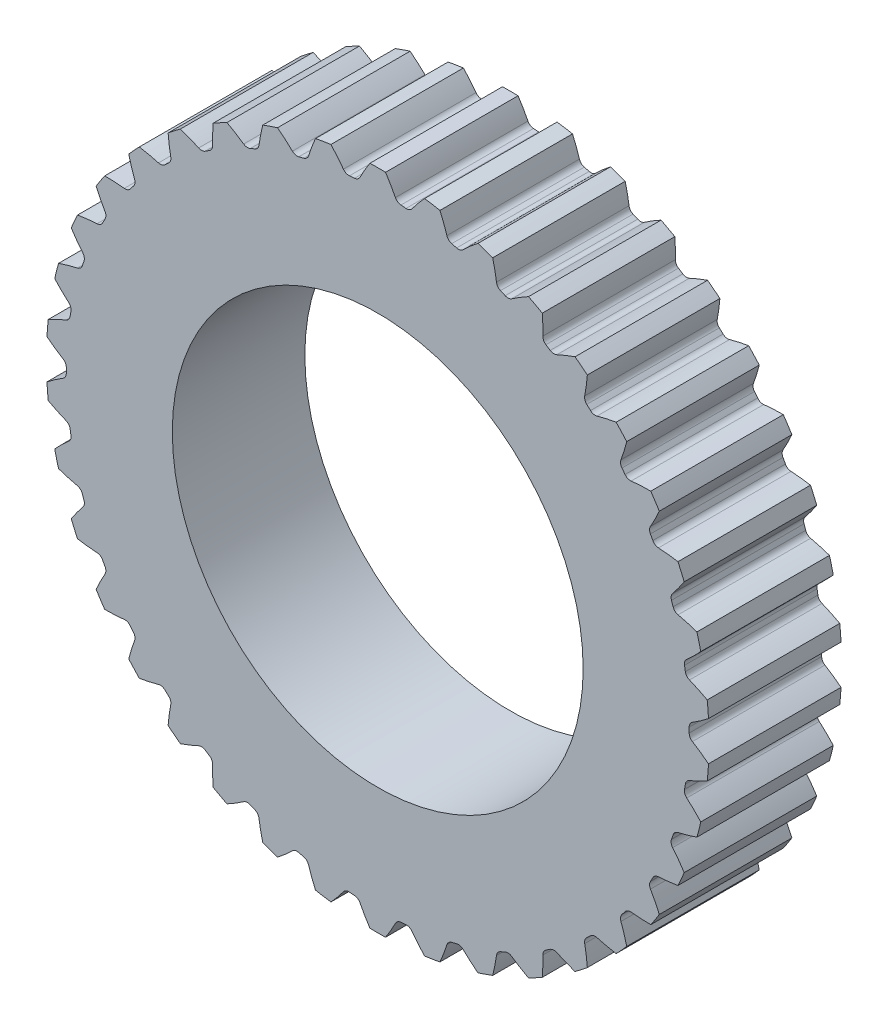
from build123d import *

# Parameters (mm, degrees)
SKETCH_1_R      = 31
EXTRUDE_1_DEPTH = 20


with BuildPart() as part:
    # Эскиз1 → Бобышка-Вытянуть1 (new body)
    with BuildSketch(Plane.XY):
        with BuildLine():
            ThreePointArc((46.99841859, -0.385551656), (47, 0), (46.99841859, 0.385551656))
            ThreePointArc((46.99841859, 0.385551656), (47.125829296, 0.886592698), (47.483283013, 1.260092972))
            add(Edge.make_bspline(
                [(47.483283013, 1.260092972), (47.534634624, 1.291586115), (47.611545405, 1.339157881), (47.713817176, 1.403216187), (47.790528777, 1.451665581), (47.867184465, 1.500480177), (47.943783427, 1.549658913), (48.020324851, 1.599200748), (48.096807923, 1.64910466), (48.173231833, 1.699369644), (48.249595768, 1.749994717), (48.325898917, 1.80097891), (48.402140469, 1.852321272), (48.478319614, 1.904020869), (48.554435541, 1.956076783), (48.630487441, 2.00848811), (48.706474502, 2.061253963), (48.782395917, 2.114373467), (48.858250874, 2.167845763), (48.934038566, 2.221670005), (49.009758184, 2.27584536), (49.085408918, 2.330371007), (49.160989961, 2.385246138), (49.236500505, 2.440469958), (49.311939741, 2.496041682), (49.387306862, 2.551960536), (49.46260106, 2.60822576), (49.537821528, 2.664836601), (49.61296746, 2.721792317), (49.688038047, 2.779092178), (49.788109055, 2.856010171), (49.862929008, 2.914122605), (49.912718147, 2.953060641)],
                knots=[0, 0, 0, 0, 0.060997592, 0.091571508, 0.122195505, 0.152869582, 0.183593739, 0.214367977, 0.245192294, 0.276066693, 0.306991171, 0.33796573, 0.368990369, 0.400065088, 0.431189887, 0.462364767, 0.493589727, 0.524864767, 0.556189888, 0.587565088, 0.618990369, 0.65046573, 0.681991172, 0.713566694, 0.745192296, 0.776867978, 0.80859374, 0.840369583, 0.872195506, 0.904071509, 0.935997593, 1, 1, 1, 1], degree=3))
            ThreePointArc((49.912718147, 2.953060641), (49.82922465, 4.128967274), (49.718031534, 5.30257865))
            add(Edge.make_bspline(
                [(49.718031534, 5.30257865), (49.662512464, 5.3327906), (49.579147965, 5.377795496), (49.46778151, 5.437193281), (49.38430354, 5.481355434), (49.300807899, 5.525165735), (49.217295502, 5.568623595), (49.133767267, 5.611728417), (49.050224114, 5.654479591), (48.966666966, 5.696876499), (48.883096746, 5.738918511), (48.79951438, 5.780604986), (48.715920796, 5.821935273), (48.632316925, 5.862908707), (48.5487037, 5.903524612), (48.465082054, 5.9437823), (48.381452926, 5.983681069), (48.297817255, 6.023220205), (48.214175983, 6.062398979), (48.130530056, 6.101216648), (48.046880421, 6.139672455), (47.963228029, 6.177765627), (47.879573833, 6.215495377), (47.79591879, 6.252860899), (47.712263858, 6.289861372), (47.628610001, 6.32649596), (47.544958185, 6.362763804), (47.461309379, 6.398664032), (47.377664557, 6.434195749), (47.294024694, 6.469358042), (47.182604125, 6.515709295), (47.098912252, 6.549973146), (47.043077409, 6.572584567)],
                knots=[0, 0, 0, 0, 0.064002407, 0.095928491, 0.127804494, 0.159630417, 0.19140626, 0.223132022, 0.254807704, 0.286433306, 0.318008828, 0.34953427, 0.381009631, 0.412434912, 0.443810112, 0.475135233, 0.506410273, 0.537635233, 0.568810113, 0.599934912, 0.631009631, 0.66203427, 0.693008829, 0.723933307, 0.754807706, 0.785632023, 0.816406261, 0.847130418, 0.877804495, 0.908428492, 0.939002408, 1, 1, 1, 1], degree=3))
            ThreePointArc((47.043077409, 6.572584567), (46.62902277, 6.882155835), (46.420881135, 7.355392218))
            ThreePointArc((46.420881135, 7.355392218), (46.35898126, 7.735945743), (46.293961701, 8.115978685))
            ThreePointArc((46.293961701, 8.115978685), (46.337166046, 8.631157294), (46.628268436, 9.058398459))
            add(Edge.make_bspline(
                [(46.628268436, 9.058398459), (46.673736077, 9.097914274), (46.74176784, 9.157496322), (46.832101107, 9.237514336), (46.899791953, 9.297929258), (46.967367539, 9.358695198), (47.034827238, 9.419810975), (47.102170418, 9.481275428), (47.169396447, 9.543087415), (47.236504689, 9.605245813), (47.303494506, 9.667749516), (47.370365258, 9.730597437), (47.4371163, 9.793788503), (47.503746987, 9.857321661), (47.57025667, 9.921195869), (47.6366447, 9.985410106), (47.702910423, 10.04996336), (47.769053185, 10.114854638), (47.835072329, 10.180082957), (47.900967197, 10.245647351), (47.966737127, 10.311546863), (48.032381458, 10.377780553), (48.097899524, 10.44434749), (48.16329066, 10.511246756), (48.228554198, 10.578477444), (48.293689469, 10.646038659), (48.358695801, 10.713929516), (48.423572522, 10.782149141), (48.488318958, 10.850696669), (48.552934433, 10.919571247), (48.638980318, 11.011911325), (48.703214832, 11.081546141), (48.745915922, 11.128148136)],
                knots=[0, 0, 0, 0, 0.060997592, 0.091571508, 0.122195505, 0.152869582, 0.183593739, 0.214367977, 0.245192294, 0.276066693, 0.306991171, 0.33796573, 0.368990369, 0.400065088, 0.431189887, 0.462364767, 0.493589727, 0.524864767, 0.556189888, 0.587565088, 0.618990369, 0.65046573, 0.681991172, 0.713566694, 0.745192296, 0.776867978, 0.80859374, 0.840369583, 0.872195506, 0.904071509, 0.935997593, 1, 1, 1, 1], degree=3))
            ThreePointArc((48.745915922, 11.128148136), (48.470013297, 12.274274357), (48.167166626, 13.413577419))
            add(Edge.make_bspline(
                [(48.167166626, 13.413577419), (48.107432041, 13.434239178), (48.017796962, 13.464908921), (47.898172846, 13.505166281), (47.808564556, 13.534986098), (47.718996747, 13.564455953), (47.629470422, 13.593575416), (47.539986583, 13.622344048), (47.450546238, 13.650761401), (47.361150398, 13.678827015), (47.27180008, 13.706540423), (47.1824963, 13.733901144), (47.093240082, 13.760908688), (47.004032454, 13.787562552), (46.914874445, 13.813862225), (46.825767092, 13.83980718), (46.736711434, 13.86539688), (46.647708517, 13.890630775), (46.558759389, 13.915508301), (46.469865105, 13.94002888), (46.381026725, 13.964191923), (46.292245312, 13.987996822), (46.203521938, 14.011442959), (46.114857677, 14.034529696), (46.026253612, 14.057256383), (45.93771083, 14.079622349), (45.849230425, 14.101626912), (45.760813496, 14.123269366), (45.672461151, 14.144548991), (45.584174504, 14.165465047), (45.466644401, 14.192844908), (45.378454332, 14.212866215), (45.319659285, 14.225979131)],
                knots=[0, 0, 0, 0, 0.064002407, 0.095928491, 0.127804494, 0.159630417, 0.19140626, 0.223132022, 0.254807704, 0.286433306, 0.318008828, 0.34953427, 0.381009631, 0.412434912, 0.443810112, 0.475135233, 0.506410273, 0.537635233, 0.568810113, 0.599934912, 0.631009631, 0.66203427, 0.693008829, 0.723933307, 0.754807706, 0.785632023, 0.816406261, 0.847130418, 0.877804495, 0.908428492, 0.939002408, 1, 1, 1, 1], degree=3))
            ThreePointArc((45.319659285, 14.225979131), (44.860298056, 14.463177097), (44.577103053, 14.895700166))
            ThreePointArc((44.577103053, 14.895700166), (44.45341036, 15.260875053), (44.326726217, 15.625022973))
            ThreePointArc((44.326726217, 15.625022973), (44.284545699, 16.140286419), (44.501356247, 16.609614449))
            add(Edge.make_bspline(
                [(44.501356247, 16.609614449), (44.53969968, 16.656075048), (44.596996695, 16.726042134), (44.672927401, 16.819837174), (44.729751064, 16.890569663), (44.786403262, 16.961629411), (44.842883571, 17.033015149), (44.899191562, 17.104725631), (44.955326797, 17.176759624), (45.011288834, 17.249115916), (45.067077226, 17.321793311), (45.12269152, 17.394790632), (45.178131257, 17.468106715), (45.233395974, 17.541740413), (45.288485203, 17.615690595), (45.343398471, 17.689956144), (45.398135299, 17.764535955), (45.452695207, 17.839428941), (45.507077708, 17.914634025), (45.561282311, 17.990150145), (45.615308522, 18.065976249), (45.669155842, 18.142111299), (45.72282377, 18.218554269), (45.776311799, 18.295304143), (45.82961942, 18.372359918), (45.882746119, 18.449720599), (45.935691382, 18.527385204), (45.988454688, 18.605352759), (46.041035515, 18.683622302), (46.093433336, 18.762192878), (46.16310699, 18.867436245), (46.215003915, 18.946693986), (46.249452181, 18.999688759)],
                knots=[0, 0, 0, 0, 0.060997592, 0.091571508, 0.122195505, 0.152869582, 0.183593739, 0.214367977, 0.245192294, 0.276066693, 0.306991171, 0.33796573, 0.368990369, 0.400065088, 0.431189887, 0.462364767, 0.493589727, 0.524864767, 0.556189888, 0.587565088, 0.618990369, 0.65046573, 0.681991172, 0.713566694, 0.745192296, 0.776867978, 0.80859374, 0.840369583, 0.872195506, 0.904071509, 0.935997593, 1, 1, 1, 1], degree=3))
            ThreePointArc((46.249452181, 18.999688759), (45.788666333, 20.084771233), (45.302426975, 21.158688762))
            add(Edge.make_bspline(
                [(45.302426975, 21.158688762), (45.240106278, 21.169236732), (45.146645631, 21.184734731), (45.022026888, 21.204753551), (44.928732558, 21.219417624), (44.835535759, 21.233743172), (44.74243755, 21.247729934), (44.649438992, 21.261377644), (44.556541155, 21.274686024), (44.46374511, 21.287654789), (44.371051936, 21.300283643), (44.278462716, 21.31257228), (44.185978542, 21.324520385), (44.093600507, 21.336127633), (44.001329713, 21.347393687), (43.909167269, 21.358318198), (43.817114289, 21.368900809), (43.725171893, 21.379141147), (43.633341209, 21.389038831), (43.541623372, 21.398593463), (43.450019525, 21.407804636), (43.358530818, 21.416671928), (43.267158407, 21.425194902), (43.17590346, 21.433373109), (43.084767149, 21.441206083), (42.993750658, 21.448693345), (42.902855178, 21.455834397), (42.81208191, 21.462628728), (42.721432065, 21.469075809), (42.630906862, 21.475175093), (42.51047314, 21.482836709), (42.42019047, 21.488069343), (42.360038996, 21.49132607)],
                knots=[0, 0, 0, 0, 0.064002407, 0.095928491, 0.127804494, 0.159630417, 0.19140626, 0.223132022, 0.254807704, 0.286433306, 0.318008828, 0.34953427, 0.381009631, 0.412434912, 0.443810112, 0.475135233, 0.506410273, 0.537635233, 0.568810113, 0.599934912, 0.631009631, 0.66203427, 0.693008829, 0.723933307, 0.754807706, 0.785632023, 0.816406261, 0.847130418, 0.877804495, 0.908428492, 0.939002408, 1, 1, 1, 1], degree=3))
            ThreePointArc((42.360038996, 21.49132607), (41.867901353, 21.649680592), (41.517377803, 22.029692244))
            ThreePointArc((41.517377803, 22.029692244), (41.335266307, 22.369527473), (41.150373192, 22.707857366))
            ThreePointArc((41.150373192, 22.707857366), (41.023958386, 23.209150604), (41.160563066, 23.707763456))
            add(Edge.make_bspline(
                [(41.160563066, 23.707763456), (41.190736381, 23.759901514), (41.235735735, 23.838345119), (41.29519269, 23.943358701), (41.339599167, 24.022479358), (41.383782653, 24.101894588), (41.427742938, 24.181603072), (41.471479804, 24.261603506), (41.514993022, 24.341894606), (41.558282355, 24.422475101), (41.601347561, 24.503343739), (41.644188384, 24.584499283), (41.686804564, 24.665940511), (41.729195834, 24.747666215), (41.771361918, 24.829675202), (41.813302533, 24.911966292), (41.855017389, 24.994538318), (41.89650619, 25.077390127), (41.937768634, 25.160520577), (41.978804413, 25.24392854), (42.01961321, 25.327612897), (42.060194706, 25.411572542), (42.100548573, 25.49580638), (42.140674481, 25.580313326), (42.180572092, 25.665092306), (42.220241063, 25.750142256), (42.259681048, 25.83546212), (42.298891693, 25.921050855), (42.337872642, 26.006907422), (42.376623534, 26.093030796), (42.428024441, 26.208306687), (42.466168165, 26.295025409), (42.491423948, 26.352967401)],
                knots=[0, 0, 0, 0, 0.060997592, 0.091571508, 0.122195505, 0.152869582, 0.183593739, 0.214367977, 0.245192294, 0.276066693, 0.306991171, 0.33796573, 0.368990369, 0.400065088, 0.431189887, 0.462364767, 0.493589727, 0.524864767, 0.556189888, 0.587565088, 0.618990369, 0.65046573, 0.681991172, 0.713566694, 0.745192296, 0.776867978, 0.80859374, 0.840369583, 0.872195506, 0.904071509, 0.935997593, 1, 1, 1, 1], degree=3))
            ThreePointArc((42.491423948, 26.352967401), (41.858323913, 27.347407906), (41.201955211, 28.326646233))
            add(Edge.make_bspline(
                [(41.201955211, 28.326646233), (41.138748348, 28.326792692), (41.044011496, 28.326696202), (40.917797401, 28.32593042), (40.823361856, 28.325038752), (40.729078233, 28.323829229), (40.634947616, 28.322301769), (40.540971098, 28.320456282), (40.447149779, 28.318292672), (40.353484762, 28.315810833), (40.259977162, 28.31301065), (40.166628095, 28.309892002), (40.073438691, 28.306454756), (39.980410082, 28.302698771), (39.88754341, 28.298623897), (39.794839826, 28.294229973), (39.702300488, 28.289516828), (39.609926562, 28.28448428), (39.517719224, 28.279132138), (39.425679658, 28.273460198), (39.333809059, 28.267468246), (39.24210863, 28.261156053), (39.150579584, 28.25452338), (39.059223147, 28.247569976), (38.968040551, 28.240295575), (38.877033044, 28.232699898), (38.786201881, 28.224782651), (38.695548332, 28.216543528), (38.605073678, 28.207982205), (38.514779212, 28.199098344), (38.394726989, 28.186832726), (38.304814393, 28.177133955), (38.244947267, 28.170445657)],
                knots=[0, 0, 0, 0, 0.064002407, 0.095928491, 0.127804494, 0.159630417, 0.19140626, 0.223132022, 0.254807704, 0.286433306, 0.318008828, 0.34953427, 0.381009631, 0.412434912, 0.443810112, 0.475135233, 0.506410273, 0.537635233, 0.568810113, 0.599934912, 0.631009631, 0.66203427, 0.693008829, 0.723933307, 0.754807706, 0.785632023, 0.816406261, 0.847130418, 0.877804495, 0.908428492, 0.939002408, 1, 1, 1, 1], degree=3))
            ThreePointArc((38.244947267, 28.170445657), (37.733457442, 28.245637236), (37.325166715, 28.562771744))
            ThreePointArc((37.325166715, 28.562771744), (37.089603942, 28.867997496), (36.851545258, 29.171280604))
            ThreePointArc((36.851545258, 29.171280604), (36.64434443, 29.644929663), (36.697017022, 30.159226477))
            add(Edge.make_bspline(
                [(36.697017022, 30.159226477), (36.71819717, 30.215619804), (36.749671399, 30.300400191), (36.791032771, 30.413767817), (36.821810769, 30.499118437), (36.852320332, 30.584722911), (36.882561471, 30.6705799), (36.912534184, 30.756688084), (36.942238458, 30.843046157), (36.971674268, 30.92965283), (37.00084158, 31.016506825), (37.029740347, 31.103606881), (37.058370513, 31.19095175), (37.086732012, 31.278540195), (37.11482477, 31.366370996), (37.142648701, 31.454442941), (37.170203712, 31.542754832), (37.1974897, 31.631305482), (37.224506556, 31.720093717), (37.251254161, 31.80911837), (37.277732387, 31.898378289), (37.3039411, 31.987872329), (37.32988016, 32.077599355), (37.355549416, 32.167558244), (37.380948714, 32.25774788), (37.406077891, 32.348167158), (37.430936777, 32.438814979), (37.455525198, 32.529690254), (37.479842971, 32.620791903), (37.50388991, 32.712118854), (37.535615987, 32.834282843), (37.558966048, 32.926097086), (37.574340437, 32.987405789)],
                knots=[0, 0, 0, 0, 0.060997592, 0.091571508, 0.122195505, 0.152869582, 0.183593739, 0.214367977, 0.245192294, 0.276066693, 0.306991171, 0.33796573, 0.368990369, 0.400065088, 0.431189887, 0.462364767, 0.493589727, 0.524864767, 0.556189888, 0.587565088, 0.618990369, 0.65046573, 0.681991172, 0.713566694, 0.745192296, 0.776867978, 0.80859374, 0.840369583, 0.872195506, 0.904071509, 0.935997593, 1, 1, 1, 1], degree=3))
            ThreePointArc((37.574340437, 32.987405789), (36.786195534, 33.864078581), (35.977601514, 34.721926636))
            add(Edge.make_bspline(
                [(35.977601514, 34.721926636), (35.915232604, 34.71166759), (35.821803721, 34.695979242), (35.697437065, 34.674449748), (35.604436262, 34.658026661), (35.511637625, 34.64131506), (35.419042239, 34.624315042), (35.326651195, 34.607026699), (35.234465595, 34.589450116), (35.142486545, 34.571585371), (35.05071516, 34.553432534), (34.959152567, 34.534991669), (34.867799896, 34.51626283), (34.776658291, 34.497246066), (34.685728902, 34.477941416), (34.59501289, 34.458348911), (34.504511426, 34.438468573), (34.41422569, 34.418300414), (34.324156873, 34.397844439), (34.234306178, 34.377100643), (34.144674817, 34.356069009), (34.055264015, 34.334749511), (33.966075009, 34.313142114), (33.877109046, 34.29124677), (33.78836739, 34.26906342), (33.699851313, 34.246591995), (33.611562105, 34.223832411), (33.523501068, 34.200784575), (33.435669518, 34.177448379), (33.348068786, 34.153823702), (33.231672773, 34.121965424), (33.144582832, 34.097599804), (33.086633074, 34.081148922)],
                knots=[0, 0, 0, 0, 0.064002407, 0.095928491, 0.127804494, 0.159630417, 0.19140626, 0.223132022, 0.254807704, 0.286433306, 0.318008828, 0.34953427, 0.381009631, 0.412434912, 0.443810112, 0.475135233, 0.506410273, 0.537635233, 0.568810113, 0.599934912, 0.631009631, 0.66203427, 0.693008829, 0.723933307, 0.754807706, 0.785632023, 0.816406261, 0.847130418, 0.877804495, 0.908428492, 0.939002408, 1, 1, 1, 1], degree=3))
            ThreePointArc((33.086633074, 34.081148922), (32.569743177, 34.071126527), (32.114822378, 34.316733289))
            ThreePointArc((32.114822378, 34.316733289), (31.832233866, 34.579023802), (31.547503234, 34.838987352))
            ThreePointArc((31.547503234, 34.838987352), (31.265168282, 35.272072319), (31.232472016, 35.788024418))
            add(Edge.make_bspline(
                [(31.232472016, 35.788024418), (31.244081257, 35.847134752), (31.261171826, 35.935939333), (31.283309385, 36.05456863), (31.299619361, 36.143821071), (31.31562278, 36.23327972), (31.331319873, 36.32294326), (31.346710856, 36.412810387), (31.361795931, 36.502879812), (31.376575285, 36.593150257), (31.391049095, 36.683620459), (31.405217522, 36.774289164), (31.419080717, 36.865155133), (31.432638818, 36.956217136), (31.445891953, 37.047473955), (31.458840236, 37.138924382), (31.471483773, 37.230567219), (31.483822658, 37.322401281), (31.495856976, 37.414425388), (31.507586802, 37.506638372), (31.5190122, 37.599039074), (31.530133226, 37.691626344), (31.540949927, 37.78439904), (31.551462342, 37.877356028), (31.5616705, 37.970496182), (31.571574424, 38.063818385), (31.581174127, 38.157321526), (31.590469614, 38.251004502), (31.599460886, 38.344866218), (31.608147934, 38.438905584), (31.619333778, 38.564625356), (31.627253246, 38.659030665), (31.632326868, 38.72203374)],
                knots=[0, 0, 0, 0, 0.060997592, 0.091571508, 0.122195505, 0.152869582, 0.183593739, 0.214367977, 0.245192294, 0.276066693, 0.306991171, 0.33796573, 0.368990369, 0.400065088, 0.431189887, 0.462364767, 0.493589727, 0.524864767, 0.556189888, 0.587565088, 0.618990369, 0.65046573, 0.681991172, 0.713566694, 0.745192296, 0.776867978, 0.80859374, 0.840369583, 0.872195506, 0.904071509, 0.935997593, 1, 1, 1, 1], degree=3))
            ThreePointArc((31.632326868, 38.72203374), (30.710635634, 39.45702547), (29.771872634, 40.170083394))
            add(Edge.make_bspline(
                [(29.771872634, 40.170083394), (29.712042938, 40.149698683), (29.62247052, 40.118846415), (29.503343702, 40.077140476), (29.41431446, 40.04563395), (29.325532114, 40.013876119), (29.23699772, 39.98186726), (29.148712338, 39.949607641), (29.060677039, 39.917097529), (28.972892903, 39.884337181), (28.88536102, 39.851326852), (28.798082487, 39.818066788), (28.711058414, 39.784557232), (28.624289917, 39.750798417), (28.537778128, 39.716790571), (28.451524185, 39.682533917), (28.365529239, 39.648028669), (28.279794452, 39.613275035), (28.194321, 39.578273213), (28.109110067, 39.543023396), (28.024162855, 39.507525769), (27.939480573, 39.471780508), (27.855064449, 39.435787779), (27.770915722, 39.399547743), (27.687035645, 39.363060548), (27.603425488, 39.326326337), (27.520086534, 39.289345238), (27.437020083, 39.252117374), (27.354227453, 39.214642855), (27.271709975, 39.176921781), (27.162145152, 39.126339855), (27.080253454, 39.087972017), (27.025801781, 39.062207286)],
                knots=[0, 0, 0, 0, 0.064002407, 0.095928491, 0.127804494, 0.159630417, 0.19140626, 0.223132022, 0.254807704, 0.286433306, 0.318008828, 0.34953427, 0.381009631, 0.412434912, 0.443810112, 0.475135233, 0.506410273, 0.537635233, 0.568810113, 0.599934912, 0.631009631, 0.66203427, 0.693008829, 0.723933307, 0.754807706, 0.785632023, 0.816406261, 0.847130418, 0.877804495, 0.908428492, 0.939002408, 1, 1, 1, 1], degree=3))
            ThreePointArc((27.025801781, 39.062207286), (26.51761122, 38.967244303), (26.028469404, 39.134623807))
            ThreePointArc((26.028469404, 39.134623807), (25.706563432, 39.346824478), (25.38292756, 39.556377343))
            ThreePointArc((25.38292756, 39.556377343), (25.033159846, 39.93708479), (24.91598659, 40.440618346))
            add(Edge.make_bspline(
                [(24.91598659, 40.440618346), (24.917708255, 40.500833311), (24.919948977, 40.591239728), (24.922258868, 40.711894799), (24.923655928, 40.802614487), (24.924716672, 40.893487112), (24.925441544, 40.984511415), (24.925830971, 41.075686144), (24.925885365, 41.167010061), (24.925605121, 41.258481937), (24.924990621, 41.350100553), (24.924042231, 41.441864702), (24.922760303, 41.533773185), (24.921145176, 41.625824811), (24.919197177, 41.7180184), (24.916916617, 41.810352779), (24.914303797, 41.902826786), (24.911359006, 41.995439264), (24.908082522, 42.088189066), (24.904474609, 42.181075051), (24.900535524, 42.274096087), (24.89626551, 42.367251048), (24.891664802, 42.460538816), (24.886733624, 42.553958278), (24.88147219, 42.64750833), (24.875880708, 42.741187871), (24.869959372, 42.83499581), (24.86370837, 42.92893106), (24.857127882, 43.022992539), (24.850218079, 43.117179172), (24.840558568, 43.243025419), (24.832831422, 43.337446665), (24.827465881, 43.40042555)],
                knots=[0, 0, 0, 0, 0.060997592, 0.091571508, 0.122195505, 0.152869582, 0.183593739, 0.214367977, 0.245192294, 0.276066693, 0.306991171, 0.33796573, 0.368990369, 0.400065088, 0.431189887, 0.462364767, 0.493589727, 0.524864767, 0.556189888, 0.587565088, 0.618990369, 0.65046573, 0.681991172, 0.713566694, 0.745192296, 0.776867978, 0.80859374, 0.840369583, 0.872195506, 0.904071509, 0.935997593, 1, 1, 1, 1], degree=3))
            ThreePointArc((24.827465881, 43.40042555), (23.797369652, 43.97368756), (22.754044679, 44.522504992))
            add(Edge.make_bspline(
                [(22.754044679, 44.522504992), (22.698386194, 44.492550658), (22.615113544, 44.447376039), (22.504476032, 44.386631285), (22.421846837, 44.340900735), (22.339502534, 44.294962946), (22.257444118, 44.248818363), (22.175672592, 44.202467428), (22.094188969, 44.155910577), (22.012994271, 44.109148244), (21.93208953, 44.062180858), (21.851475789, 44.015008844), (21.771154102, 43.967632623), (21.691125533, 43.920052609), (21.611391159, 43.872269213), (21.531952067, 43.824282843), (21.452809357, 43.776093899), (21.373964142, 43.727702776), (21.295417546, 43.679109866), (21.217170709, 43.630315552), (21.139224783, 43.581320215), (21.061580934, 43.532124227), (20.984240345, 43.482727955), (20.90720421, 43.43313176), (20.830473743, 43.383335997), (20.754050172, 43.333341012), (20.677934742, 43.283147146), (20.602128714, 43.232754734), (20.52663337, 43.182164099), (20.451450008, 43.131375561), (20.351705017, 43.063449729), (20.277245354, 43.012126248), (20.227777067, 42.977750464)],
                knots=[0, 0, 0, 0, 0.064002407, 0.095928491, 0.127804494, 0.159630417, 0.19140626, 0.223132022, 0.254807704, 0.286433306, 0.318008828, 0.34953427, 0.381009631, 0.412434912, 0.443810112, 0.475135233, 0.506410273, 0.537635233, 0.568810113, 0.599934912, 0.631009631, 0.66203427, 0.693008829, 0.723933307, 0.754807706, 0.785632023, 0.816406261, 0.847130418, 0.877804495, 0.908428492, 0.939002408, 1, 1, 1, 1], degree=3))
            ThreePointArc((20.227777067, 42.977750464), (19.742147956, 42.800437235), (19.232127636, 42.885023803))
            ThreePointArc((19.232127636, 42.885023803), (18.879684959, 43.041346353), (18.525971791, 43.194772475))
            ThreePointArc((18.525971791, 43.194772475), (18.118312066, 43.512717696), (17.919858001, 43.990097627))
            add(Edge.make_bspline(
                [(17.919858001, 43.990097627), (17.911645128, 44.049774714), (17.898974882, 44.139316916), (17.881394097, 44.258706605), (17.867840133, 44.348418943), (17.853929267, 44.438226777), (17.839662145, 44.528128937), (17.825039394, 44.618124259), (17.810061623, 44.70821159), (17.794729425, 44.798389782), (17.779043378, 44.888657697), (17.76300404, 44.979014202), (17.746611957, 45.069458175), (17.729867659, 45.159988495), (17.712771661, 45.250604054), (17.695324465, 45.341303745), (17.67752656, 45.432086471), (17.65937842, 45.522951139), (17.640880507, 45.613896662), (17.622033271, 45.704921961), (17.60283715, 45.796025959), (17.583292571, 45.887207587), (17.563399948, 45.978465779), (17.543159687, 46.069799476), (17.52257218, 46.161207624), (17.501637812, 46.252689171), (17.480356956, 46.344243072), (17.458729976, 46.435868286), (17.436757227, 46.527563776), (17.414439055, 46.61932851), (17.384197675, 46.741868476), (17.361034691, 46.833730092), (17.345376345, 46.894966888)],
                knots=[0, 0, 0, 0, 0.060997592, 0.091571508, 0.122195505, 0.152869582, 0.183593739, 0.214367977, 0.245192294, 0.276066693, 0.306991171, 0.33796573, 0.368990369, 0.400065088, 0.431189887, 0.462364767, 0.493589727, 0.524864767, 0.556189888, 0.587565088, 0.618990369, 0.65046573, 0.681991172, 0.713566694, 0.745192296, 0.776867978, 0.80859374, 0.840369583, 0.872195506, 0.904071509, 0.935997593, 1, 1, 1, 1], degree=3))
            ThreePointArc((17.345376345, 46.894966888), (16.23497346, 47.290862085), (15.1155457, 47.660468716))
            add(Edge.make_bspline(
                [(15.1155457, 47.660468716), (15.065576646, 47.621761834), (14.990875224, 47.563497111), (14.891744921, 47.4853705), (14.817769681, 47.426663336), (14.744109559, 47.367798652), (14.670765462, 47.30877705), (14.597738306, 47.24959913), (14.525029019, 47.190265491), (14.452638538, 47.130776727), (14.38056781, 47.071133432), (14.308817793, 47.011336197), (14.237389459, 46.95138561), (14.166283789, 46.891282256), (14.095501776, 46.831026718), (14.025044427, 46.770619574), (13.95491276, 46.710061402), (13.885107807, 46.649352776), (13.815630615, 46.588494265), (13.746482243, 46.527486436), (13.677663765, 46.466329853), (13.609176271, 46.405025077), (13.541020865, 46.343572663), (13.473198669, 46.281973165), (13.405710819, 46.220227131), (13.338558469, 46.158335106), (13.271742793, 46.096297631), (13.205264979, 46.034115243), (13.139126238, 45.971788474), (13.073327798, 45.90931785), (12.986123423, 45.825900952), (12.92112686, 45.763021799), (12.877991324, 45.720972644)],
                knots=[0, 0, 0, 0, 0.064002407, 0.095928491, 0.127804494, 0.159630417, 0.19140626, 0.223132022, 0.254807704, 0.286433306, 0.318008828, 0.34953427, 0.381009631, 0.412434912, 0.443810112, 0.475135233, 0.506410273, 0.537635233, 0.568810113, 0.599934912, 0.631009631, 0.66203427, 0.693008829, 0.723933307, 0.754807706, 0.785632023, 0.816406261, 0.847130418, 0.877804495, 0.908428492, 0.939002408, 1, 1, 1, 1], degree=3))
            ThreePointArc((12.877991324, 45.720972644), (12.428170359, 45.466145811), (11.91118356, 45.465632143))
            ThreePointArc((11.91118356, 45.465632143), (11.537817896, 45.561812499), (11.163675805, 45.654926815))
            ThreePointArc((11.163675805, 45.654926815), (10.709243964, 45.901437092), (10.434922399, 46.339641718))
            add(Edge.make_bspline(
                [(10.434922399, 46.339641718), (10.416999013, 46.397153093), (10.389763411, 46.483388602), (10.352771508, 46.598256269), (10.324636237, 46.684514138), (10.296133214, 46.770807458), (10.267263267, 46.857135178), (10.238027208, 46.943496255), (10.208425827, 47.029889652), (10.178459898, 47.116314335), (10.148130177, 47.202769274), (10.117437403, 47.289253447), (10.086382298, 47.375765833), (10.054965569, 47.462305417), (10.023187908, 47.548871188), (9.991049991, 47.63546214), (9.95855248, 47.722077269), (9.925696024, 47.808715575), (9.892481257, 47.895376064), (9.858908801, 47.982057743), (9.824979265, 48.068759624), (9.790693246, 48.155480721), (9.756051328, 48.242220053), (9.721054085, 48.32897664), (9.685702079, 48.415749507), (9.649995861, 48.502537681), (9.613935971, 48.589340193), (9.57752294, 48.676156075), (9.540757289, 48.762984362), (9.503639529, 48.849824094), (9.453641186, 48.965715207), (9.41567419, 49.052511448), (9.390150158, 49.110335776)],
                knots=[0, 0, 0, 0, 0.060997592, 0.091571508, 0.122195505, 0.152869582, 0.183593739, 0.214367977, 0.245192294, 0.276066693, 0.306991171, 0.33796573, 0.368990369, 0.400065088, 0.431189887, 0.462364767, 0.493589727, 0.524864767, 0.556189888, 0.587565088, 0.618990369, 0.65046573, 0.681991172, 0.713566694, 0.745192296, 0.776867978, 0.80859374, 0.840369583, 0.872195506, 0.904071509, 0.935997593, 1, 1, 1, 1], degree=3))
            ThreePointArc((9.390150158, 49.110335776), (8.229729514, 49.31806517), (7.064734037, 49.498379095))
            add(Edge.make_bspline(
                [(7.064734037, 49.498379095), (7.021817439, 49.451975488), (6.957724906, 49.38220997), (6.872805829, 49.288832592), (6.809502396, 49.218750194), (6.746535711, 49.14856429), (6.683906568, 49.078275624), (6.621615773, 49.007884939), (6.559664142, 48.937392978), (6.498052501, 48.866800481), (6.436781687, 48.796108192), (6.375852549, 48.725316849), (6.315265947, 48.654427192), (6.255022752, 48.583439961), (6.195123849, 48.512355893), (6.135570135, 48.441175725), (6.07636252, 48.369900195), (6.017501928, 48.298530037), (5.958989296, 48.227065987), (5.900825576, 48.155508777), (5.843011735, 48.083859142), (5.785548756, 48.012117811), (5.728437636, 47.940285517), (5.671679389, 47.868362989), (5.615275049, 47.796350956), (5.559225662, 47.724250144), (5.503532297, 47.652061281), (5.448196039, 47.579785091), (5.393217993, 47.507422298), (5.338599285, 47.434973626), (5.266314234, 47.338341057), (5.212553708, 47.265621411), (5.176927548, 47.217045875)],
                knots=[0, 0, 0, 0, 0.064002407, 0.095928491, 0.127804494, 0.159630417, 0.19140626, 0.223132022, 0.254807704, 0.286433306, 0.318008828, 0.34953427, 0.381009631, 0.412434912, 0.443810112, 0.475135233, 0.506410273, 0.537635233, 0.568810113, 0.599934912, 0.631009631, 0.66203427, 0.693008829, 0.723933307, 0.754807706, 0.785632023, 0.816406261, 0.847130418, 0.877804495, 0.908428492, 0.939002408, 1, 1, 1, 1], degree=3))
            ThreePointArc((5.176927548, 47.217045875), (4.775184673, 46.891656451), (4.265333447, 46.806056559))
            ThreePointArc((4.265333447, 46.806056559), (3.881229237, 46.839471171), (3.496863844, 46.869733766))
            ThreePointArc((3.496863844, 46.869733766), (3.008055603, 47.038084941), (2.665349317, 47.425161181))
            add(Edge.make_bspline(
                [(2.665349317, 47.425161181), (2.638204321, 47.478938083), (2.597146278, 47.55951462), (2.5417523, 47.666726974), (2.499803179, 47.747177486), (2.457485486, 47.827602433), (2.414800212, 47.908000919), (2.371748329, 47.988372046), (2.328330786, 48.068714923), (2.284548519, 48.149028655), (2.24040244, 48.229312354), (2.195893448, 48.309565131), (2.151022424, 48.389786098), (2.105790231, 48.469974372), (2.060197718, 48.550129068), (2.014245718, 48.630249304), (1.967935049, 48.710334201), (1.921266516, 48.790382879), (1.874240907, 48.870394461), (1.826859, 48.95036807), (1.779121559, 49.030302832), (1.731029333, 49.110197873), (1.682583061, 49.190052321), (1.633783469, 49.269865305), (1.584631274, 49.349635954), (1.535127178, 49.429363401), (1.485271874, 49.509046776), (1.435066045, 49.588685215), (1.384510363, 49.66827785), (1.333605491, 49.747823819), (1.26521401, 49.853904871), (1.213478642, 49.933268163), (1.178785154, 49.986102724)],
                knots=[0, 0, 0, 0, 0.060997592, 0.091571508, 0.122195505, 0.152869582, 0.183593739, 0.214367977, 0.245192294, 0.276066693, 0.306991171, 0.33796573, 0.368990369, 0.400065088, 0.431189887, 0.462364767, 0.493589727, 0.524864767, 0.556189888, 0.587565088, 0.618990369, 0.65046573, 0.681991172, 0.713566694, 0.745192296, 0.776867978, 0.80859374, 0.840369583, 0.872195506, 0.904071509, 0.935997593, 1, 1, 1, 1], degree=3))
            ThreePointArc((1.178785154, 49.986102724), (0, 50), (-1.178785154, 49.986102724))
            add(Edge.make_bspline(
                [(-1.178785154, 49.986102724), (-1.213478642, 49.933268163), (-1.26521401, 49.853904871), (-1.333605491, 49.747823819), (-1.384510363, 49.66827785), (-1.435066045, 49.588685215), (-1.485271874, 49.509046776), (-1.535127178, 49.429363401), (-1.584631274, 49.349635954), (-1.633783469, 49.269865305), (-1.682583061, 49.190052321), (-1.731029333, 49.110197873), (-1.779121559, 49.030302832), (-1.826859, 48.95036807), (-1.874240907, 48.870394461), (-1.921266516, 48.790382879), (-1.967935049, 48.710334201), (-2.014245718, 48.630249304), (-2.060197718, 48.550129068), (-2.105790231, 48.469974372), (-2.151022424, 48.389786098), (-2.195893448, 48.309565131), (-2.24040244, 48.229312354), (-2.284548519, 48.149028655), (-2.328330786, 48.068714923), (-2.371748329, 47.988372046), (-2.414800212, 47.908000919), (-2.457485486, 47.827602433), (-2.499803179, 47.747177486), (-2.5417523, 47.666726974), (-2.597146278, 47.55951462), (-2.638204321, 47.478938083), (-2.665349317, 47.425161181)],
                knots=[0, 0, 0, 0, 0.064002407, 0.095928491, 0.127804494, 0.159630417, 0.19140626, 0.223132022, 0.254807704, 0.286433306, 0.318008828, 0.34953427, 0.381009631, 0.412434912, 0.443810112, 0.475135233, 0.506410273, 0.537635233, 0.568810113, 0.599934912, 0.631009631, 0.66203427, 0.693008829, 0.723933307, 0.754807706, 0.785632023, 0.816406261, 0.847130418, 0.877804495, 0.908428492, 0.939002408, 1, 1, 1, 1], degree=3))
            ThreePointArc((-2.665349317, 47.425161181), (-3.008055603, 47.038084941), (-3.496863844, 46.869733766))
            ThreePointArc((-3.496863844, 46.869733766), (-3.881229237, 46.839471171), (-4.265333447, 46.806056559))
            ThreePointArc((-4.265333447, 46.806056559), (-4.775184673, 46.891656451), (-5.176927548, 47.217045875))
            add(Edge.make_bspline(
                [(-5.176927548, 47.217045875), (-5.212553708, 47.265621411), (-5.266314234, 47.338341057), (-5.338599285, 47.434973626), (-5.393217993, 47.507422298), (-5.448196039, 47.579785091), (-5.503532297, 47.652061281), (-5.559225662, 47.724250144), (-5.615275049, 47.796350956), (-5.671679389, 47.868362989), (-5.728437636, 47.940285517), (-5.785548756, 48.012117811), (-5.843011735, 48.083859142), (-5.900825576, 48.155508777), (-5.958989296, 48.227065987), (-6.017501928, 48.298530037), (-6.07636252, 48.369900195), (-6.135570135, 48.441175725), (-6.195123849, 48.512355893), (-6.255022752, 48.583439961), (-6.315265947, 48.654427192), (-6.375852549, 48.725316849), (-6.436781687, 48.796108192), (-6.498052501, 48.866800481), (-6.559664142, 48.937392978), (-6.621615773, 49.007884939), (-6.683906568, 49.078275624), (-6.746535711, 49.14856429), (-6.809502396, 49.218750194), (-6.872805829, 49.288832592), (-6.957724906, 49.38220997), (-7.021817439, 49.451975488), (-7.064734037, 49.498379095)],
                knots=[0, 0, 0, 0, 0.060997592, 0.091571508, 0.122195505, 0.152869582, 0.183593739, 0.214367977, 0.245192294, 0.276066693, 0.306991171, 0.33796573, 0.368990369, 0.400065088, 0.431189887, 0.462364767, 0.493589727, 0.524864767, 0.556189888, 0.587565088, 0.618990369, 0.65046573, 0.681991172, 0.713566694, 0.745192296, 0.776867978, 0.80859374, 0.840369583, 0.872195506, 0.904071509, 0.935997593, 1, 1, 1, 1], degree=3))
            ThreePointArc((-7.064734037, 49.498379095), (-8.229729514, 49.31806517), (-9.390150158, 49.110335776))
            add(Edge.make_bspline(
                [(-9.390150158, 49.110335776), (-9.41567419, 49.052511448), (-9.453641186, 48.965715207), (-9.503639529, 48.849824094), (-9.540757289, 48.762984362), (-9.57752294, 48.676156075), (-9.613935971, 48.589340193), (-9.649995861, 48.502537681), (-9.685702079, 48.415749507), (-9.721054085, 48.32897664), (-9.756051328, 48.242220053), (-9.790693246, 48.155480721), (-9.824979265, 48.068759624), (-9.858908801, 47.982057743), (-9.892481257, 47.895376064), (-9.925696024, 47.808715575), (-9.95855248, 47.722077269), (-9.991049991, 47.63546214), (-10.023187908, 47.548871188), (-10.054965569, 47.462305417), (-10.086382298, 47.375765833), (-10.117437403, 47.289253447), (-10.148130177, 47.202769274), (-10.178459898, 47.116314335), (-10.208425827, 47.029889652), (-10.238027208, 46.943496255), (-10.267263267, 46.857135178), (-10.296133214, 46.770807458), (-10.324636237, 46.684514138), (-10.352771508, 46.598256269), (-10.389763411, 46.483388602), (-10.416999013, 46.397153093), (-10.434922399, 46.339641718)],
                knots=[0, 0, 0, 0, 0.064002407, 0.095928491, 0.127804494, 0.159630417, 0.19140626, 0.223132022, 0.254807704, 0.286433306, 0.318008828, 0.34953427, 0.381009631, 0.412434912, 0.443810112, 0.475135233, 0.506410273, 0.537635233, 0.568810113, 0.599934912, 0.631009631, 0.66203427, 0.693008829, 0.723933307, 0.754807706, 0.785632023, 0.816406261, 0.847130418, 0.877804495, 0.908428492, 0.939002408, 1, 1, 1, 1], degree=3))
            ThreePointArc((-10.434922399, 46.339641718), (-10.709243964, 45.901437092), (-11.163675805, 45.654926815))
            ThreePointArc((-11.163675805, 45.654926815), (-11.537817896, 45.561812499), (-11.91118356, 45.465632143))
            ThreePointArc((-11.91118356, 45.465632143), (-12.428170359, 45.466145811), (-12.877991324, 45.720972644))
            add(Edge.make_bspline(
                [(-12.877991324, 45.720972644), (-12.92112686, 45.763021799), (-12.986123423, 45.825900952), (-13.073327798, 45.90931785), (-13.139126238, 45.971788474), (-13.205264979, 46.034115243), (-13.271742793, 46.096297631), (-13.338558469, 46.158335106), (-13.405710819, 46.220227131), (-13.473198669, 46.281973165), (-13.541020865, 46.343572663), (-13.609176271, 46.405025077), (-13.677663765, 46.466329853), (-13.746482243, 46.527486436), (-13.815630615, 46.588494265), (-13.885107807, 46.649352776), (-13.95491276, 46.710061402), (-14.025044427, 46.770619574), (-14.095501776, 46.831026718), (-14.166283789, 46.891282256), (-14.237389459, 46.95138561), (-14.308817793, 47.011336197), (-14.38056781, 47.071133432), (-14.452638538, 47.130776727), (-14.525029019, 47.190265491), (-14.597738306, 47.24959913), (-14.670765462, 47.30877705), (-14.744109559, 47.367798652), (-14.817769681, 47.426663336), (-14.891744921, 47.4853705), (-14.990875224, 47.563497111), (-15.065576646, 47.621761834), (-15.1155457, 47.660468716)],
                knots=[0, 0, 0, 0, 0.060997592, 0.091571508, 0.122195505, 0.152869582, 0.183593739, 0.214367977, 0.245192294, 0.276066693, 0.306991171, 0.33796573, 0.368990369, 0.400065088, 0.431189887, 0.462364767, 0.493589727, 0.524864767, 0.556189888, 0.587565088, 0.618990369, 0.65046573, 0.681991172, 0.713566694, 0.745192296, 0.776867978, 0.80859374, 0.840369583, 0.872195506, 0.904071509, 0.935997593, 1, 1, 1, 1], degree=3))
            ThreePointArc((-15.1155457, 47.660468716), (-16.23497346, 47.290862085), (-17.345376345, 46.894966888))
            add(Edge.make_bspline(
                [(-17.345376345, 46.894966888), (-17.361034691, 46.833730092), (-17.384197675, 46.741868476), (-17.414439055, 46.61932851), (-17.436757227, 46.527563776), (-17.458729976, 46.435868286), (-17.480356956, 46.344243072), (-17.501637812, 46.252689171), (-17.52257218, 46.161207624), (-17.543159687, 46.069799476), (-17.563399948, 45.978465779), (-17.583292571, 45.887207587), (-17.60283715, 45.796025959), (-17.622033271, 45.704921961), (-17.640880507, 45.613896662), (-17.65937842, 45.522951139), (-17.67752656, 45.432086471), (-17.695324465, 45.341303745), (-17.712771661, 45.250604054), (-17.729867659, 45.159988495), (-17.746611957, 45.069458175), (-17.76300404, 44.979014202), (-17.779043378, 44.888657697), (-17.794729425, 44.798389782), (-17.810061623, 44.70821159), (-17.825039394, 44.618124259), (-17.839662145, 44.528128937), (-17.853929267, 44.438226777), (-17.867840133, 44.348418943), (-17.881394097, 44.258706605), (-17.898974882, 44.139316916), (-17.911645128, 44.049774714), (-17.919858001, 43.990097627)],
                knots=[0, 0, 0, 0, 0.064002407, 0.095928491, 0.127804494, 0.159630417, 0.19140626, 0.223132022, 0.254807704, 0.286433306, 0.318008828, 0.34953427, 0.381009631, 0.412434912, 0.443810112, 0.475135233, 0.506410273, 0.537635233, 0.568810113, 0.599934912, 0.631009631, 0.66203427, 0.693008829, 0.723933307, 0.754807706, 0.785632023, 0.816406261, 0.847130418, 0.877804495, 0.908428492, 0.939002408, 1, 1, 1, 1], degree=3))
            ThreePointArc((-17.919858001, 43.990097627), (-18.118312066, 43.512717696), (-18.525971791, 43.194772475))
            ThreePointArc((-18.525971791, 43.194772475), (-18.879684959, 43.041346353), (-19.232127636, 42.885023803))
            ThreePointArc((-19.232127636, 42.885023803), (-19.742147956, 42.800437235), (-20.227777067, 42.977750464))
            add(Edge.make_bspline(
                [(-20.227777067, 42.977750464), (-20.277245354, 43.012126248), (-20.351705017, 43.063449729), (-20.451450008, 43.131375561), (-20.52663337, 43.182164099), (-20.602128714, 43.232754734), (-20.677934742, 43.283147146), (-20.754050172, 43.333341012), (-20.830473743, 43.383335997), (-20.90720421, 43.43313176), (-20.984240345, 43.482727955), (-21.061580934, 43.532124227), (-21.139224783, 43.581320215), (-21.217170709, 43.630315552), (-21.295417546, 43.679109866), (-21.373964142, 43.727702776), (-21.452809357, 43.776093899), (-21.531952067, 43.824282843), (-21.611391159, 43.872269213), (-21.691125533, 43.920052609), (-21.771154102, 43.967632623), (-21.851475789, 44.015008844), (-21.93208953, 44.062180858), (-22.012994271, 44.109148244), (-22.094188969, 44.155910577), (-22.175672592, 44.202467428), (-22.257444118, 44.248818363), (-22.339502534, 44.294962946), (-22.421846837, 44.340900735), (-22.504476032, 44.386631285), (-22.615113544, 44.447376039), (-22.698386194, 44.492550658), (-22.754044679, 44.522504992)],
                knots=[0, 0, 0, 0, 0.060997592, 0.091571508, 0.122195505, 0.152869582, 0.183593739, 0.214367977, 0.245192294, 0.276066693, 0.306991171, 0.33796573, 0.368990369, 0.400065088, 0.431189887, 0.462364767, 0.493589727, 0.524864767, 0.556189888, 0.587565088, 0.618990369, 0.65046573, 0.681991172, 0.713566694, 0.745192296, 0.776867978, 0.80859374, 0.840369583, 0.872195506, 0.904071509, 0.935997593, 1, 1, 1, 1], degree=3))
            ThreePointArc((-22.754044679, 44.522504992), (-23.797369652, 43.97368756), (-24.827465881, 43.40042555))
            add(Edge.make_bspline(
                [(-24.827465881, 43.40042555), (-24.832831422, 43.337446665), (-24.840558568, 43.243025419), (-24.850218079, 43.117179172), (-24.857127882, 43.022992539), (-24.86370837, 42.92893106), (-24.869959372, 42.83499581), (-24.875880708, 42.741187871), (-24.88147219, 42.64750833), (-24.886733624, 42.553958278), (-24.891664802, 42.460538816), (-24.89626551, 42.367251048), (-24.900535524, 42.274096087), (-24.904474609, 42.181075051), (-24.908082522, 42.088189066), (-24.911359006, 41.995439264), (-24.914303797, 41.902826786), (-24.916916617, 41.810352779), (-24.919197177, 41.7180184), (-24.921145176, 41.625824811), (-24.922760303, 41.533773185), (-24.924042231, 41.441864702), (-24.924990621, 41.350100553), (-24.925605121, 41.258481937), (-24.925885365, 41.167010061), (-24.925830971, 41.075686144), (-24.925441544, 40.984511415), (-24.924716672, 40.893487112), (-24.923655928, 40.802614487), (-24.922258868, 40.711894799), (-24.919948977, 40.591239728), (-24.917708255, 40.500833311), (-24.91598659, 40.440618346)],
                knots=[0, 0, 0, 0, 0.064002407, 0.095928491, 0.127804494, 0.159630417, 0.19140626, 0.223132022, 0.254807704, 0.286433306, 0.318008828, 0.34953427, 0.381009631, 0.412434912, 0.443810112, 0.475135233, 0.506410273, 0.537635233, 0.568810113, 0.599934912, 0.631009631, 0.66203427, 0.693008829, 0.723933307, 0.754807706, 0.785632023, 0.816406261, 0.847130418, 0.877804495, 0.908428492, 0.939002408, 1, 1, 1, 1], degree=3))
            ThreePointArc((-24.91598659, 40.440618346), (-25.033159846, 39.93708479), (-25.38292756, 39.556377343))
            ThreePointArc((-25.38292756, 39.556377343), (-25.706563432, 39.346824478), (-26.028469404, 39.134623807))
            ThreePointArc((-26.028469404, 39.134623807), (-26.51761122, 38.967244303), (-27.025801781, 39.062207286))
            add(Edge.make_bspline(
                [(-27.025801781, 39.062207286), (-27.080253454, 39.087972017), (-27.162145152, 39.126339855), (-27.271709975, 39.176921781), (-27.354227453, 39.214642855), (-27.437020083, 39.252117374), (-27.520086534, 39.289345238), (-27.603425488, 39.326326337), (-27.687035645, 39.363060548), (-27.770915722, 39.399547743), (-27.855064449, 39.435787779), (-27.939480573, 39.471780508), (-28.024162855, 39.507525769), (-28.109110067, 39.543023396), (-28.194321, 39.578273213), (-28.279794452, 39.613275035), (-28.365529239, 39.648028669), (-28.451524185, 39.682533917), (-28.537778128, 39.716790571), (-28.624289917, 39.750798417), (-28.711058414, 39.784557232), (-28.798082487, 39.818066788), (-28.88536102, 39.851326852), (-28.972892903, 39.884337181), (-29.060677039, 39.917097529), (-29.148712338, 39.949607641), (-29.23699772, 39.98186726), (-29.325532114, 40.013876119), (-29.41431446, 40.04563395), (-29.503343702, 40.077140476), (-29.62247052, 40.118846415), (-29.712042938, 40.149698683), (-29.771872634, 40.170083394)],
                knots=[0, 0, 0, 0, 0.060997592, 0.091571508, 0.122195505, 0.152869582, 0.183593739, 0.214367977, 0.245192294, 0.276066693, 0.306991171, 0.33796573, 0.368990369, 0.400065088, 0.431189887, 0.462364767, 0.493589727, 0.524864767, 0.556189888, 0.587565088, 0.618990369, 0.65046573, 0.681991172, 0.713566694, 0.745192296, 0.776867978, 0.80859374, 0.840369583, 0.872195506, 0.904071509, 0.935997593, 1, 1, 1, 1], degree=3))
            ThreePointArc((-29.771872634, 40.170083394), (-30.710635634, 39.45702547), (-31.632326868, 38.72203374))
            add(Edge.make_bspline(
                [(-31.632326868, 38.72203374), (-31.627253246, 38.659030665), (-31.619333778, 38.564625356), (-31.608147934, 38.438905584), (-31.599460886, 38.344866218), (-31.590469614, 38.251004502), (-31.581174127, 38.157321526), (-31.571574424, 38.063818385), (-31.5616705, 37.970496182), (-31.551462342, 37.877356028), (-31.540949927, 37.78439904), (-31.530133226, 37.691626344), (-31.5190122, 37.599039074), (-31.507586802, 37.506638372), (-31.495856976, 37.414425388), (-31.483822658, 37.322401281), (-31.471483773, 37.230567219), (-31.458840236, 37.138924382), (-31.445891953, 37.047473955), (-31.432638818, 36.956217136), (-31.419080717, 36.865155133), (-31.405217522, 36.774289164), (-31.391049095, 36.683620459), (-31.376575285, 36.593150257), (-31.361795931, 36.502879812), (-31.346710856, 36.412810387), (-31.331319873, 36.32294326), (-31.31562278, 36.23327972), (-31.299619361, 36.143821071), (-31.283309385, 36.05456863), (-31.261171826, 35.935939333), (-31.244081257, 35.847134752), (-31.232472016, 35.788024418)],
                knots=[0, 0, 0, 0, 0.064002407, 0.095928491, 0.127804494, 0.159630417, 0.19140626, 0.223132022, 0.254807704, 0.286433306, 0.318008828, 0.34953427, 0.381009631, 0.412434912, 0.443810112, 0.475135233, 0.506410273, 0.537635233, 0.568810113, 0.599934912, 0.631009631, 0.66203427, 0.693008829, 0.723933307, 0.754807706, 0.785632023, 0.816406261, 0.847130418, 0.877804495, 0.908428492, 0.939002408, 1, 1, 1, 1], degree=3))
            ThreePointArc((-31.232472016, 35.788024418), (-31.265168282, 35.272072319), (-31.547503234, 34.838987352))
            ThreePointArc((-31.547503234, 34.838987352), (-31.832233866, 34.579023802), (-32.114822378, 34.316733289))
            ThreePointArc((-32.114822378, 34.316733289), (-32.569743177, 34.071126527), (-33.086633074, 34.081148922))
            add(Edge.make_bspline(
                [(-33.086633074, 34.081148922), (-33.144582832, 34.097599804), (-33.231672773, 34.121965424), (-33.348068786, 34.153823702), (-33.435669518, 34.177448379), (-33.523501068, 34.200784575), (-33.611562105, 34.223832411), (-33.699851313, 34.246591995), (-33.78836739, 34.26906342), (-33.877109046, 34.29124677), (-33.966075009, 34.313142114), (-34.055264015, 34.334749511), (-34.144674817, 34.356069009), (-34.234306178, 34.377100643), (-34.324156873, 34.397844439), (-34.41422569, 34.418300414), (-34.504511426, 34.438468573), (-34.59501289, 34.458348911), (-34.685728902, 34.477941416), (-34.776658291, 34.497246066), (-34.867799896, 34.51626283), (-34.959152567, 34.534991669), (-35.05071516, 34.553432534), (-35.142486545, 34.571585371), (-35.234465595, 34.589450116), (-35.326651195, 34.607026699), (-35.419042239, 34.624315042), (-35.511637625, 34.64131506), (-35.604436262, 34.658026661), (-35.697437065, 34.674449748), (-35.821803721, 34.695979242), (-35.915232604, 34.71166759), (-35.977601514, 34.721926636)],
                knots=[0, 0, 0, 0, 0.060997592, 0.091571508, 0.122195505, 0.152869582, 0.183593739, 0.214367977, 0.245192294, 0.276066693, 0.306991171, 0.33796573, 0.368990369, 0.400065088, 0.431189887, 0.462364767, 0.493589727, 0.524864767, 0.556189888, 0.587565088, 0.618990369, 0.65046573, 0.681991172, 0.713566694, 0.745192296, 0.776867978, 0.80859374, 0.840369583, 0.872195506, 0.904071509, 0.935997593, 1, 1, 1, 1], degree=3))
            ThreePointArc((-35.977601514, 34.721926636), (-36.786195534, 33.864078581), (-37.574340437, 32.987405789))
            add(Edge.make_bspline(
                [(-37.574340437, 32.987405789), (-37.558966048, 32.926097086), (-37.535615987, 32.834282843), (-37.50388991, 32.712118854), (-37.479842971, 32.620791903), (-37.455525198, 32.529690254), (-37.430936777, 32.438814979), (-37.406077891, 32.348167158), (-37.380948714, 32.25774788), (-37.355549416, 32.167558244), (-37.32988016, 32.077599355), (-37.3039411, 31.987872329), (-37.277732387, 31.898378289), (-37.251254161, 31.80911837), (-37.224506556, 31.720093717), (-37.1974897, 31.631305482), (-37.170203712, 31.542754832), (-37.142648701, 31.454442941), (-37.11482477, 31.366370996), (-37.086732012, 31.278540195), (-37.058370513, 31.19095175), (-37.029740347, 31.103606881), (-37.00084158, 31.016506825), (-36.971674268, 30.92965283), (-36.942238458, 30.843046157), (-36.912534184, 30.756688084), (-36.882561471, 30.6705799), (-36.852320332, 30.584722911), (-36.821810769, 30.499118437), (-36.791032771, 30.413767817), (-36.749671399, 30.300400191), (-36.71819717, 30.215619804), (-36.697017022, 30.159226477)],
                knots=[0, 0, 0, 0, 0.064002407, 0.095928491, 0.127804494, 0.159630417, 0.19140626, 0.223132022, 0.254807704, 0.286433306, 0.318008828, 0.34953427, 0.381009631, 0.412434912, 0.443810112, 0.475135233, 0.506410273, 0.537635233, 0.568810113, 0.599934912, 0.631009631, 0.66203427, 0.693008829, 0.723933307, 0.754807706, 0.785632023, 0.816406261, 0.847130418, 0.877804495, 0.908428492, 0.939002408, 1, 1, 1, 1], degree=3))
            ThreePointArc((-36.697017022, 30.159226477), (-36.64434443, 29.644929663), (-36.851545258, 29.171280604))
            ThreePointArc((-36.851545258, 29.171280604), (-37.089603942, 28.867997496), (-37.325166715, 28.562771744))
            ThreePointArc((-37.325166715, 28.562771744), (-37.733457442, 28.245637236), (-38.244947267, 28.170445657))
            add(Edge.make_bspline(
                [(-38.244947267, 28.170445657), (-38.304814393, 28.177133955), (-38.394726989, 28.186832726), (-38.514779212, 28.199098344), (-38.605073678, 28.207982205), (-38.695548332, 28.216543528), (-38.786201881, 28.224782651), (-38.877033044, 28.232699898), (-38.968040551, 28.240295575), (-39.059223147, 28.247569976), (-39.150579584, 28.25452338), (-39.24210863, 28.261156053), (-39.333809059, 28.267468246), (-39.425679658, 28.273460198), (-39.517719224, 28.279132138), (-39.609926562, 28.28448428), (-39.702300488, 28.289516828), (-39.794839826, 28.294229973), (-39.88754341, 28.298623897), (-39.980410082, 28.302698771), (-40.073438691, 28.306454756), (-40.166628095, 28.309892002), (-40.259977162, 28.31301065), (-40.353484762, 28.315810833), (-40.447149779, 28.318292672), (-40.540971098, 28.320456282), (-40.634947616, 28.322301769), (-40.729078233, 28.323829229), (-40.823361856, 28.325038752), (-40.917797401, 28.32593042), (-41.044011496, 28.326696202), (-41.138748348, 28.326792692), (-41.201955211, 28.326646233)],
                knots=[0, 0, 0, 0, 0.060997592, 0.091571508, 0.122195505, 0.152869582, 0.183593739, 0.214367977, 0.245192294, 0.276066693, 0.306991171, 0.33796573, 0.368990369, 0.400065088, 0.431189887, 0.462364767, 0.493589727, 0.524864767, 0.556189888, 0.587565088, 0.618990369, 0.65046573, 0.681991172, 0.713566694, 0.745192296, 0.776867978, 0.80859374, 0.840369583, 0.872195506, 0.904071509, 0.935997593, 1, 1, 1, 1], degree=3))
            ThreePointArc((-41.201955211, 28.326646233), (-41.858323913, 27.347407906), (-42.491423948, 26.352967401))
            add(Edge.make_bspline(
                [(-42.491423948, 26.352967401), (-42.466168165, 26.295025409), (-42.428024441, 26.208306687), (-42.376623534, 26.093030796), (-42.337872642, 26.006907422), (-42.298891693, 25.921050855), (-42.259681048, 25.83546212), (-42.220241063, 25.750142256), (-42.180572092, 25.665092306), (-42.140674481, 25.580313326), (-42.100548573, 25.49580638), (-42.060194706, 25.411572542), (-42.01961321, 25.327612897), (-41.978804413, 25.24392854), (-41.937768634, 25.160520577), (-41.89650619, 25.077390127), (-41.855017389, 24.994538318), (-41.813302533, 24.911966292), (-41.771361918, 24.829675202), (-41.729195834, 24.747666215), (-41.686804564, 24.665940511), (-41.644188384, 24.584499283), (-41.601347561, 24.503343739), (-41.558282355, 24.422475101), (-41.514993022, 24.341894606), (-41.471479804, 24.261603506), (-41.427742938, 24.181603072), (-41.383782653, 24.101894588), (-41.339599167, 24.022479358), (-41.29519269, 23.943358701), (-41.235735735, 23.838345119), (-41.190736381, 23.759901514), (-41.160563066, 23.707763456)],
                knots=[0, 0, 0, 0, 0.064002407, 0.095928491, 0.127804494, 0.159630417, 0.19140626, 0.223132022, 0.254807704, 0.286433306, 0.318008828, 0.34953427, 0.381009631, 0.412434912, 0.443810112, 0.475135233, 0.506410273, 0.537635233, 0.568810113, 0.599934912, 0.631009631, 0.66203427, 0.693008829, 0.723933307, 0.754807706, 0.785632023, 0.816406261, 0.847130418, 0.877804495, 0.908428492, 0.939002408, 1, 1, 1, 1], degree=3))
            ThreePointArc((-41.160563066, 23.707763456), (-41.023958386, 23.209150604), (-41.150373192, 22.707857366))
            ThreePointArc((-41.150373192, 22.707857366), (-41.335266307, 22.369527473), (-41.517377803, 22.029692244))
            ThreePointArc((-41.517377803, 22.029692244), (-41.867901353, 21.649680592), (-42.360038996, 21.49132607))
            add(Edge.make_bspline(
                [(-42.360038996, 21.49132607), (-42.42019047, 21.488069343), (-42.51047314, 21.482836709), (-42.630906862, 21.475175093), (-42.721432065, 21.469075809), (-42.81208191, 21.462628728), (-42.902855178, 21.455834397), (-42.993750658, 21.448693345), (-43.084767149, 21.441206083), (-43.17590346, 21.433373109), (-43.267158407, 21.425194902), (-43.358530818, 21.416671928), (-43.450019525, 21.407804636), (-43.541623372, 21.398593463), (-43.633341209, 21.389038831), (-43.725171893, 21.379141147), (-43.817114289, 21.368900809), (-43.909167269, 21.358318198), (-44.001329713, 21.347393687), (-44.093600507, 21.336127633), (-44.185978542, 21.324520385), (-44.278462716, 21.31257228), (-44.371051936, 21.300283643), (-44.46374511, 21.287654789), (-44.556541155, 21.274686024), (-44.649438992, 21.261377644), (-44.74243755, 21.247729934), (-44.835535759, 21.233743172), (-44.928732558, 21.219417624), (-45.022026888, 21.204753551), (-45.146645631, 21.184734731), (-45.240106278, 21.169236732), (-45.302426975, 21.158688762)],
                knots=[0, 0, 0, 0, 0.060997592, 0.091571508, 0.122195505, 0.152869582, 0.183593739, 0.214367977, 0.245192294, 0.276066693, 0.306991171, 0.33796573, 0.368990369, 0.400065088, 0.431189887, 0.462364767, 0.493589727, 0.524864767, 0.556189888, 0.587565088, 0.618990369, 0.65046573, 0.681991172, 0.713566694, 0.745192296, 0.776867978, 0.80859374, 0.840369583, 0.872195506, 0.904071509, 0.935997593, 1, 1, 1, 1], degree=3))
            ThreePointArc((-45.302426975, 21.158688762), (-45.788666333, 20.084771233), (-46.249452181, 18.999688759))
            add(Edge.make_bspline(
                [(-46.249452181, 18.999688759), (-46.215003915, 18.946693986), (-46.16310699, 18.867436245), (-46.093433336, 18.762192878), (-46.041035515, 18.683622302), (-45.988454688, 18.605352759), (-45.935691382, 18.527385204), (-45.882746119, 18.449720599), (-45.82961942, 18.372359918), (-45.776311799, 18.295304143), (-45.72282377, 18.218554269), (-45.669155842, 18.142111299), (-45.615308522, 18.065976249), (-45.561282311, 17.990150145), (-45.507077708, 17.914634025), (-45.452695207, 17.839428941), (-45.398135299, 17.764535955), (-45.343398471, 17.689956144), (-45.288485203, 17.615690595), (-45.233395974, 17.541740413), (-45.178131257, 17.468106715), (-45.12269152, 17.394790632), (-45.067077226, 17.321793311), (-45.011288834, 17.249115916), (-44.955326797, 17.176759624), (-44.899191562, 17.104725631), (-44.842883571, 17.033015149), (-44.786403262, 16.961629411), (-44.729751064, 16.890569663), (-44.672927401, 16.819837174), (-44.596996695, 16.726042134), (-44.53969968, 16.656075048), (-44.501356247, 16.609614449)],
                knots=[0, 0, 0, 0, 0.064002407, 0.095928491, 0.127804494, 0.159630417, 0.19140626, 0.223132022, 0.254807704, 0.286433306, 0.318008828, 0.34953427, 0.381009631, 0.412434912, 0.443810112, 0.475135233, 0.506410273, 0.537635233, 0.568810113, 0.599934912, 0.631009631, 0.66203427, 0.693008829, 0.723933307, 0.754807706, 0.785632023, 0.816406261, 0.847130418, 0.877804495, 0.908428492, 0.939002408, 1, 1, 1, 1], degree=3))
            ThreePointArc((-44.501356247, 16.609614449), (-44.284545699, 16.140286419), (-44.326726217, 15.625022973))
            ThreePointArc((-44.326726217, 15.625022973), (-44.45341036, 15.260875053), (-44.577103053, 14.895700166))
            ThreePointArc((-44.577103053, 14.895700166), (-44.860298056, 14.463177097), (-45.319659285, 14.225979131))
            add(Edge.make_bspline(
                [(-45.319659285, 14.225979131), (-45.378454332, 14.212866215), (-45.466644401, 14.192844908), (-45.584174504, 14.165465047), (-45.672461151, 14.144548991), (-45.760813496, 14.123269366), (-45.849230425, 14.101626912), (-45.93771083, 14.079622349), (-46.026253612, 14.057256383), (-46.114857677, 14.034529696), (-46.203521938, 14.011442959), (-46.292245312, 13.987996822), (-46.381026725, 13.964191923), (-46.469865105, 13.94002888), (-46.558759389, 13.915508301), (-46.647708517, 13.890630775), (-46.736711434, 13.86539688), (-46.825767092, 13.83980718), (-46.914874445, 13.813862225), (-47.004032454, 13.787562552), (-47.093240082, 13.760908688), (-47.1824963, 13.733901144), (-47.27180008, 13.706540423), (-47.361150398, 13.678827015), (-47.450546238, 13.650761401), (-47.539986583, 13.622344048), (-47.629470422, 13.593575416), (-47.718996747, 13.564455953), (-47.808564556, 13.534986098), (-47.898172846, 13.505166281), (-48.017796962, 13.464908921), (-48.107432041, 13.434239178), (-48.167166626, 13.413577419)],
                knots=[0, 0, 0, 0, 0.060997592, 0.091571508, 0.122195505, 0.152869582, 0.183593739, 0.214367977, 0.245192294, 0.276066693, 0.306991171, 0.33796573, 0.368990369, 0.400065088, 0.431189887, 0.462364767, 0.493589727, 0.524864767, 0.556189888, 0.587565088, 0.618990369, 0.65046573, 0.681991172, 0.713566694, 0.745192296, 0.776867978, 0.80859374, 0.840369583, 0.872195506, 0.904071509, 0.935997593, 1, 1, 1, 1], degree=3))
            ThreePointArc((-48.167166626, 13.413577419), (-48.470013297, 12.274274357), (-48.745915922, 11.128148136))
            add(Edge.make_bspline(
                [(-48.745915922, 11.128148136), (-48.703214832, 11.081546141), (-48.638980318, 11.011911325), (-48.552934433, 10.919571247), (-48.488318958, 10.850696669), (-48.423572522, 10.782149141), (-48.358695801, 10.713929516), (-48.293689469, 10.646038659), (-48.228554198, 10.578477444), (-48.16329066, 10.511246756), (-48.097899524, 10.44434749), (-48.032381458, 10.377780553), (-47.966737127, 10.311546863), (-47.900967197, 10.245647351), (-47.835072329, 10.180082957), (-47.769053185, 10.114854638), (-47.702910423, 10.04996336), (-47.6366447, 9.985410106), (-47.57025667, 9.921195869), (-47.503746987, 9.857321661), (-47.4371163, 9.793788503), (-47.370365258, 9.730597437), (-47.303494506, 9.667749516), (-47.236504689, 9.605245813), (-47.169396447, 9.543087415), (-47.102170418, 9.481275428), (-47.034827238, 9.419810975), (-46.967367539, 9.358695198), (-46.899791953, 9.297929258), (-46.832101107, 9.237514336), (-46.74176784, 9.157496322), (-46.673736077, 9.097914274), (-46.628268436, 9.058398459)],
                knots=[0, 0, 0, 0, 0.064002407, 0.095928491, 0.127804494, 0.159630417, 0.19140626, 0.223132022, 0.254807704, 0.286433306, 0.318008828, 0.34953427, 0.381009631, 0.412434912, 0.443810112, 0.475135233, 0.506410273, 0.537635233, 0.568810113, 0.599934912, 0.631009631, 0.66203427, 0.693008829, 0.723933307, 0.754807706, 0.785632023, 0.816406261, 0.847130418, 0.877804495, 0.908428492, 0.939002408, 1, 1, 1, 1], degree=3))
            ThreePointArc((-46.628268436, 9.058398459), (-46.337166046, 8.631157294), (-46.293961701, 8.115978685))
            ThreePointArc((-46.293961701, 8.115978685), (-46.35898126, 7.735945743), (-46.420881135, 7.355392218))
            ThreePointArc((-46.420881135, 7.355392218), (-46.62902277, 6.882155835), (-47.043077409, 6.572584567))
            add(Edge.make_bspline(
                [(-47.043077409, 6.572584567), (-47.098912252, 6.549973146), (-47.182604125, 6.515709295), (-47.294024694, 6.469358042), (-47.377664557, 6.434195749), (-47.461309379, 6.398664032), (-47.544958185, 6.362763804), (-47.628610001, 6.32649596), (-47.712263858, 6.289861372), (-47.79591879, 6.252860899), (-47.879573833, 6.215495377), (-47.963228029, 6.177765627), (-48.046880421, 6.139672455), (-48.130530056, 6.101216648), (-48.214175983, 6.062398979), (-48.297817255, 6.023220205), (-48.381452926, 5.983681069), (-48.465082054, 5.9437823), (-48.5487037, 5.903524612), (-48.632316925, 5.862908707), (-48.715920796, 5.821935273), (-48.79951438, 5.780604986), (-48.883096746, 5.738918511), (-48.966666966, 5.696876499), (-49.050224114, 5.654479591), (-49.133767267, 5.611728417), (-49.217295502, 5.568623595), (-49.300807899, 5.525165735), (-49.38430354, 5.481355434), (-49.46778151, 5.437193281), (-49.579147965, 5.377795496), (-49.662512464, 5.3327906), (-49.718031534, 5.30257865)],
                knots=[0, 0, 0, 0, 0.060997592, 0.091571508, 0.122195505, 0.152869582, 0.183593739, 0.214367977, 0.245192294, 0.276066693, 0.306991171, 0.33796573, 0.368990369, 0.400065088, 0.431189887, 0.462364767, 0.493589727, 0.524864767, 0.556189888, 0.587565088, 0.618990369, 0.65046573, 0.681991172, 0.713566694, 0.745192296, 0.776867978, 0.80859374, 0.840369583, 0.872195506, 0.904071509, 0.935997593, 1, 1, 1, 1], degree=3))
            ThreePointArc((-49.718031534, 5.30257865), (-49.82922465, 4.128967274), (-49.912718147, 2.953060641))
            add(Edge.make_bspline(
                [(-49.912718147, 2.953060641), (-49.862929008, 2.914122605), (-49.788109055, 2.856010171), (-49.688038047, 2.779092178), (-49.61296746, 2.721792317), (-49.537821528, 2.664836601), (-49.46260106, 2.60822576), (-49.387306862, 2.551960536), (-49.311939741, 2.496041682), (-49.236500505, 2.440469958), (-49.160989961, 2.385246138), (-49.085408918, 2.330371007), (-49.009758184, 2.27584536), (-48.934038566, 2.221670005), (-48.858250874, 2.167845763), (-48.782395917, 2.114373467), (-48.706474502, 2.061253963), (-48.630487441, 2.00848811), (-48.554435541, 1.956076783), (-48.478319614, 1.904020869), (-48.402140469, 1.852321272), (-48.325898917, 1.80097891), (-48.249595768, 1.749994717), (-48.173231833, 1.699369644), (-48.096807923, 1.64910466), (-48.020324851, 1.599200748), (-47.943783427, 1.549658913), (-47.867184465, 1.500480177), (-47.790528777, 1.451665581), (-47.713817176, 1.403216187), (-47.611545405, 1.339157881), (-47.534634624, 1.291586115), (-47.483283013, 1.260092972)],
                knots=[0, 0, 0, 0, 0.064002407, 0.095928491, 0.127804494, 0.159630417, 0.19140626, 0.223132022, 0.254807704, 0.286433306, 0.318008828, 0.34953427, 0.381009631, 0.412434912, 0.443810112, 0.475135233, 0.506410273, 0.537635233, 0.568810113, 0.599934912, 0.631009631, 0.66203427, 0.693008829, 0.723933307, 0.754807706, 0.785632023, 0.816406261, 0.847130418, 0.877804495, 0.908428492, 0.939002408, 1, 1, 1, 1], degree=3))
            ThreePointArc((-47.483283013, 1.260092972), (-47.125829295, 0.886592698), (-46.99841859, 0.385551656))
            ThreePointArc((-46.99841859, 0.385551656), (-47, 0), (-46.99841859, -0.385551656))
            ThreePointArc((-46.99841859, -0.385551656), (-47.125829295, -0.886592698), (-47.483283013, -1.260092972))
            add(Edge.make_bspline(
                [(-47.483283013, -1.260092972), (-47.534634624, -1.291586115), (-47.611545405, -1.339157881), (-47.713817176, -1.403216187), (-47.790528777, -1.451665581), (-47.867184465, -1.500480177), (-47.943783427, -1.549658913), (-48.020324851, -1.599200748), (-48.096807923, -1.64910466), (-48.173231833, -1.699369644), (-48.249595768, -1.749994717), (-48.325898917, -1.80097891), (-48.402140469, -1.852321272), (-48.478319614, -1.904020869), (-48.554435541, -1.956076783), (-48.630487441, -2.00848811), (-48.706474502, -2.061253963), (-48.782395917, -2.114373467), (-48.858250874, -2.167845763), (-48.934038566, -2.221670005), (-49.009758184, -2.27584536), (-49.085408918, -2.330371007), (-49.160989961, -2.385246138), (-49.236500505, -2.440469958), (-49.311939741, -2.496041682), (-49.387306862, -2.551960536), (-49.46260106, -2.60822576), (-49.537821528, -2.664836601), (-49.61296746, -2.721792317), (-49.688038047, -2.779092178), (-49.788109055, -2.856010171), (-49.862929008, -2.914122605), (-49.912718147, -2.953060641)],
                knots=[0, 0, 0, 0, 0.060997592, 0.091571508, 0.122195505, 0.152869582, 0.183593739, 0.214367977, 0.245192294, 0.276066693, 0.306991171, 0.33796573, 0.368990369, 0.400065088, 0.431189887, 0.462364767, 0.493589727, 0.524864767, 0.556189888, 0.587565088, 0.618990369, 0.65046573, 0.681991172, 0.713566694, 0.745192296, 0.776867978, 0.80859374, 0.840369583, 0.872195506, 0.904071509, 0.935997593, 1, 1, 1, 1], degree=3))
            ThreePointArc((-49.912718147, -2.953060641), (-49.82922465, -4.128967274), (-49.718031534, -5.30257865))
            add(Edge.make_bspline(
                [(-49.718031534, -5.30257865), (-49.662512464, -5.3327906), (-49.579147965, -5.377795496), (-49.46778151, -5.437193281), (-49.38430354, -5.481355434), (-49.300807899, -5.525165735), (-49.217295502, -5.568623595), (-49.133767267, -5.611728417), (-49.050224114, -5.654479591), (-48.966666966, -5.696876499), (-48.883096746, -5.738918511), (-48.79951438, -5.780604986), (-48.715920796, -5.821935273), (-48.632316925, -5.862908707), (-48.5487037, -5.903524612), (-48.465082054, -5.9437823), (-48.381452926, -5.983681069), (-48.297817255, -6.023220205), (-48.214175983, -6.062398979), (-48.130530056, -6.101216648), (-48.046880421, -6.139672455), (-47.963228029, -6.177765627), (-47.879573833, -6.215495377), (-47.79591879, -6.252860899), (-47.712263858, -6.289861372), (-47.628610001, -6.32649596), (-47.544958185, -6.362763804), (-47.461309379, -6.398664032), (-47.377664557, -6.434195749), (-47.294024694, -6.469358042), (-47.182604125, -6.515709295), (-47.098912252, -6.549973146), (-47.043077409, -6.572584567)],
                knots=[0, 0, 0, 0, 0.064002407, 0.095928491, 0.127804494, 0.159630417, 0.19140626, 0.223132022, 0.254807704, 0.286433306, 0.318008828, 0.34953427, 0.381009631, 0.412434912, 0.443810112, 0.475135233, 0.506410273, 0.537635233, 0.568810113, 0.599934912, 0.631009631, 0.66203427, 0.693008829, 0.723933307, 0.754807706, 0.785632023, 0.816406261, 0.847130418, 0.877804495, 0.908428492, 0.939002408, 1, 1, 1, 1], degree=3))
            ThreePointArc((-47.043077409, -6.572584567), (-46.62902277, -6.882155835), (-46.420881135, -7.355392218))
            ThreePointArc((-46.420881135, -7.355392218), (-46.35898126, -7.735945743), (-46.293961701, -8.115978685))
            ThreePointArc((-46.293961701, -8.115978685), (-46.337166046, -8.631157294), (-46.628268436, -9.058398459))
            add(Edge.make_bspline(
                [(-46.628268436, -9.058398459), (-46.673736077, -9.097914274), (-46.74176784, -9.157496322), (-46.832101107, -9.237514336), (-46.899791953, -9.297929258), (-46.967367539, -9.358695198), (-47.034827238, -9.419810975), (-47.102170418, -9.481275428), (-47.169396447, -9.543087415), (-47.236504689, -9.605245813), (-47.303494506, -9.667749516), (-47.370365258, -9.730597437), (-47.4371163, -9.793788503), (-47.503746987, -9.857321661), (-47.57025667, -9.921195869), (-47.6366447, -9.985410106), (-47.702910423, -10.04996336), (-47.769053185, -10.114854638), (-47.835072329, -10.180082957), (-47.900967197, -10.245647351), (-47.966737127, -10.311546863), (-48.032381458, -10.377780553), (-48.097899524, -10.44434749), (-48.16329066, -10.511246756), (-48.228554198, -10.578477444), (-48.293689469, -10.646038659), (-48.358695801, -10.713929516), (-48.423572522, -10.782149141), (-48.488318958, -10.850696669), (-48.552934433, -10.919571247), (-48.638980318, -11.011911325), (-48.703214832, -11.081546141), (-48.745915922, -11.128148136)],
                knots=[0, 0, 0, 0, 0.060997592, 0.091571508, 0.122195505, 0.152869582, 0.183593739, 0.214367977, 0.245192294, 0.276066693, 0.306991171, 0.33796573, 0.368990369, 0.400065088, 0.431189887, 0.462364767, 0.493589727, 0.524864767, 0.556189888, 0.587565088, 0.618990369, 0.65046573, 0.681991172, 0.713566694, 0.745192296, 0.776867978, 0.80859374, 0.840369583, 0.872195506, 0.904071509, 0.935997593, 1, 1, 1, 1], degree=3))
            ThreePointArc((-48.745915922, -11.128148136), (-48.470013297, -12.274274357), (-48.167166626, -13.413577419))
            add(Edge.make_bspline(
                [(-48.167166626, -13.413577419), (-48.107432041, -13.434239178), (-48.017796962, -13.464908921), (-47.898172846, -13.505166281), (-47.808564556, -13.534986098), (-47.718996747, -13.564455953), (-47.629470422, -13.593575416), (-47.539986583, -13.622344048), (-47.450546238, -13.650761401), (-47.361150398, -13.678827015), (-47.27180008, -13.706540423), (-47.1824963, -13.733901144), (-47.093240082, -13.760908688), (-47.004032454, -13.787562552), (-46.914874445, -13.813862225), (-46.825767092, -13.83980718), (-46.736711434, -13.86539688), (-46.647708517, -13.890630775), (-46.558759389, -13.915508301), (-46.469865105, -13.94002888), (-46.381026725, -13.964191923), (-46.292245312, -13.987996822), (-46.203521938, -14.011442959), (-46.114857677, -14.034529696), (-46.026253612, -14.057256383), (-45.93771083, -14.079622349), (-45.849230425, -14.101626912), (-45.760813496, -14.123269366), (-45.672461151, -14.144548991), (-45.584174504, -14.165465047), (-45.466644401, -14.192844908), (-45.378454332, -14.212866215), (-45.319659285, -14.225979131)],
                knots=[0, 0, 0, 0, 0.064002407, 0.095928491, 0.127804494, 0.159630417, 0.19140626, 0.223132022, 0.254807704, 0.286433306, 0.318008828, 0.34953427, 0.381009631, 0.412434912, 0.443810112, 0.475135233, 0.506410273, 0.537635233, 0.568810113, 0.599934912, 0.631009631, 0.66203427, 0.693008829, 0.723933307, 0.754807706, 0.785632023, 0.816406261, 0.847130418, 0.877804495, 0.908428492, 0.939002408, 1, 1, 1, 1], degree=3))
            ThreePointArc((-45.319659285, -14.225979131), (-44.860298056, -14.463177097), (-44.577103053, -14.895700166))
            ThreePointArc((-44.577103053, -14.895700166), (-44.45341036, -15.260875053), (-44.326726217, -15.625022973))
            ThreePointArc((-44.326726217, -15.625022973), (-44.284545699, -16.140286419), (-44.501356247, -16.609614449))
            add(Edge.make_bspline(
                [(-44.501356247, -16.609614449), (-44.53969968, -16.656075048), (-44.596996695, -16.726042134), (-44.672927401, -16.819837174), (-44.729751064, -16.890569663), (-44.786403262, -16.961629411), (-44.842883571, -17.033015149), (-44.899191562, -17.104725631), (-44.955326797, -17.176759624), (-45.011288834, -17.249115916), (-45.067077226, -17.321793311), (-45.12269152, -17.394790632), (-45.178131257, -17.468106715), (-45.233395974, -17.541740413), (-45.288485203, -17.615690595), (-45.343398471, -17.689956144), (-45.398135299, -17.764535955), (-45.452695207, -17.839428941), (-45.507077708, -17.914634025), (-45.561282311, -17.990150145), (-45.615308522, -18.065976249), (-45.669155842, -18.142111299), (-45.72282377, -18.218554269), (-45.776311799, -18.295304143), (-45.82961942, -18.372359918), (-45.882746119, -18.449720599), (-45.935691382, -18.527385204), (-45.988454688, -18.605352759), (-46.041035515, -18.683622302), (-46.093433336, -18.762192878), (-46.16310699, -18.867436245), (-46.215003915, -18.946693986), (-46.249452181, -18.999688759)],
                knots=[0, 0, 0, 0, 0.060997592, 0.091571508, 0.122195505, 0.152869582, 0.183593739, 0.214367977, 0.245192294, 0.276066693, 0.306991171, 0.33796573, 0.368990369, 0.400065088, 0.431189887, 0.462364767, 0.493589727, 0.524864767, 0.556189888, 0.587565088, 0.618990369, 0.65046573, 0.681991172, 0.713566694, 0.745192296, 0.776867978, 0.80859374, 0.840369583, 0.872195506, 0.904071509, 0.935997593, 1, 1, 1, 1], degree=3))
            ThreePointArc((-46.249452181, -18.999688759), (-45.788666333, -20.084771233), (-45.302426975, -21.158688762))
            add(Edge.make_bspline(
                [(-45.302426975, -21.158688762), (-45.240106278, -21.169236732), (-45.146645631, -21.184734731), (-45.022026888, -21.204753551), (-44.928732558, -21.219417624), (-44.835535759, -21.233743172), (-44.74243755, -21.247729934), (-44.649438992, -21.261377644), (-44.556541155, -21.274686024), (-44.46374511, -21.287654789), (-44.371051936, -21.300283643), (-44.278462716, -21.31257228), (-44.185978542, -21.324520385), (-44.093600507, -21.336127633), (-44.001329713, -21.347393687), (-43.909167269, -21.358318198), (-43.817114289, -21.368900809), (-43.725171893, -21.379141147), (-43.633341209, -21.389038831), (-43.541623372, -21.398593463), (-43.450019525, -21.407804636), (-43.358530818, -21.416671928), (-43.267158407, -21.425194902), (-43.17590346, -21.433373109), (-43.084767149, -21.441206083), (-42.993750658, -21.448693345), (-42.902855178, -21.455834397), (-42.81208191, -21.462628728), (-42.721432065, -21.469075809), (-42.630906862, -21.475175093), (-42.51047314, -21.482836709), (-42.42019047, -21.488069343), (-42.360038996, -21.49132607)],
                knots=[0, 0, 0, 0, 0.064002407, 0.095928491, 0.127804494, 0.159630417, 0.19140626, 0.223132022, 0.254807704, 0.286433306, 0.318008828, 0.34953427, 0.381009631, 0.412434912, 0.443810112, 0.475135233, 0.506410273, 0.537635233, 0.568810113, 0.599934912, 0.631009631, 0.66203427, 0.693008829, 0.723933307, 0.754807706, 0.785632023, 0.816406261, 0.847130418, 0.877804495, 0.908428492, 0.939002408, 1, 1, 1, 1], degree=3))
            ThreePointArc((-42.360038996, -21.49132607), (-41.867901353, -21.649680592), (-41.517377803, -22.029692244))
            ThreePointArc((-41.517377803, -22.029692244), (-41.335266307, -22.369527473), (-41.150373192, -22.707857366))
            ThreePointArc((-41.150373192, -22.707857366), (-41.023958386, -23.209150604), (-41.160563066, -23.707763456))
            add(Edge.make_bspline(
                [(-41.160563066, -23.707763456), (-41.190736381, -23.759901514), (-41.235735735, -23.838345119), (-41.29519269, -23.943358701), (-41.339599167, -24.022479358), (-41.383782653, -24.101894588), (-41.427742938, -24.181603072), (-41.471479804, -24.261603506), (-41.514993022, -24.341894606), (-41.558282355, -24.422475101), (-41.601347561, -24.503343739), (-41.644188384, -24.584499283), (-41.686804564, -24.665940511), (-41.729195834, -24.747666215), (-41.771361918, -24.829675202), (-41.813302533, -24.911966292), (-41.855017389, -24.994538318), (-41.89650619, -25.077390127), (-41.937768634, -25.160520577), (-41.978804413, -25.24392854), (-42.01961321, -25.327612897), (-42.060194706, -25.411572542), (-42.100548573, -25.49580638), (-42.140674481, -25.580313326), (-42.180572092, -25.665092306), (-42.220241063, -25.750142256), (-42.259681048, -25.83546212), (-42.298891693, -25.921050855), (-42.337872642, -26.006907422), (-42.376623534, -26.093030796), (-42.428024441, -26.208306687), (-42.466168165, -26.295025409), (-42.491423948, -26.352967401)],
                knots=[0, 0, 0, 0, 0.060997592, 0.091571508, 0.122195505, 0.152869582, 0.183593739, 0.214367977, 0.245192294, 0.276066693, 0.306991171, 0.33796573, 0.368990369, 0.400065088, 0.431189887, 0.462364767, 0.493589727, 0.524864767, 0.556189888, 0.587565088, 0.618990369, 0.65046573, 0.681991172, 0.713566694, 0.745192296, 0.776867978, 0.80859374, 0.840369583, 0.872195506, 0.904071509, 0.935997593, 1, 1, 1, 1], degree=3))
            ThreePointArc((-42.491423948, -26.352967401), (-41.858323913, -27.347407906), (-41.201955211, -28.326646233))
            add(Edge.make_bspline(
                [(-41.201955211, -28.326646233), (-41.138748348, -28.326792692), (-41.044011496, -28.326696202), (-40.917797401, -28.32593042), (-40.823361856, -28.325038752), (-40.729078233, -28.323829229), (-40.634947616, -28.322301769), (-40.540971098, -28.320456282), (-40.447149779, -28.318292672), (-40.353484762, -28.315810833), (-40.259977162, -28.31301065), (-40.166628095, -28.309892002), (-40.073438691, -28.306454756), (-39.980410082, -28.302698771), (-39.88754341, -28.298623897), (-39.794839826, -28.294229973), (-39.702300488, -28.289516828), (-39.609926562, -28.28448428), (-39.517719224, -28.279132138), (-39.425679658, -28.273460198), (-39.333809059, -28.267468246), (-39.24210863, -28.261156053), (-39.150579584, -28.25452338), (-39.059223147, -28.247569976), (-38.968040551, -28.240295575), (-38.877033044, -28.232699898), (-38.786201881, -28.224782651), (-38.695548332, -28.216543528), (-38.605073678, -28.207982205), (-38.514779212, -28.199098344), (-38.394726989, -28.186832726), (-38.304814393, -28.177133955), (-38.244947267, -28.170445657)],
                knots=[0, 0, 0, 0, 0.064002407, 0.095928491, 0.127804494, 0.159630417, 0.19140626, 0.223132022, 0.254807704, 0.286433306, 0.318008828, 0.34953427, 0.381009631, 0.412434912, 0.443810112, 0.475135233, 0.506410273, 0.537635233, 0.568810113, 0.599934912, 0.631009631, 0.66203427, 0.693008829, 0.723933307, 0.754807706, 0.785632023, 0.816406261, 0.847130418, 0.877804495, 0.908428492, 0.939002408, 1, 1, 1, 1], degree=3))
            ThreePointArc((-38.244947267, -28.170445657), (-37.733457442, -28.245637236), (-37.325166715, -28.562771744))
            ThreePointArc((-37.325166715, -28.562771744), (-37.089603942, -28.867997496), (-36.851545258, -29.171280604))
            ThreePointArc((-36.851545258, -29.171280604), (-36.64434443, -29.644929663), (-36.697017022, -30.159226477))
            add(Edge.make_bspline(
                [(-36.697017022, -30.159226477), (-36.71819717, -30.215619804), (-36.749671399, -30.300400191), (-36.791032771, -30.413767817), (-36.821810769, -30.499118437), (-36.852320332, -30.584722911), (-36.882561471, -30.6705799), (-36.912534184, -30.756688084), (-36.942238458, -30.843046157), (-36.971674268, -30.92965283), (-37.00084158, -31.016506825), (-37.029740347, -31.103606881), (-37.058370513, -31.19095175), (-37.086732012, -31.278540195), (-37.11482477, -31.366370996), (-37.142648701, -31.454442941), (-37.170203712, -31.542754832), (-37.1974897, -31.631305482), (-37.224506556, -31.720093717), (-37.251254161, -31.80911837), (-37.277732387, -31.898378289), (-37.3039411, -31.987872329), (-37.32988016, -32.077599355), (-37.355549416, -32.167558244), (-37.380948714, -32.25774788), (-37.406077891, -32.348167158), (-37.430936777, -32.438814979), (-37.455525198, -32.529690254), (-37.479842971, -32.620791903), (-37.50388991, -32.712118854), (-37.535615987, -32.834282843), (-37.558966048, -32.926097086), (-37.574340437, -32.987405789)],
                knots=[0, 0, 0, 0, 0.060997592, 0.091571508, 0.122195505, 0.152869582, 0.183593739, 0.214367977, 0.245192294, 0.276066693, 0.306991171, 0.33796573, 0.368990369, 0.400065088, 0.431189887, 0.462364767, 0.493589727, 0.524864767, 0.556189888, 0.587565088, 0.618990369, 0.65046573, 0.681991172, 0.713566694, 0.745192296, 0.776867978, 0.80859374, 0.840369583, 0.872195506, 0.904071509, 0.935997593, 1, 1, 1, 1], degree=3))
            ThreePointArc((-37.574340437, -32.987405789), (-36.786195534, -33.864078581), (-35.977601514, -34.721926636))
            add(Edge.make_bspline(
                [(-35.977601514, -34.721926636), (-35.915232604, -34.71166759), (-35.821803721, -34.695979242), (-35.697437065, -34.674449748), (-35.604436262, -34.658026661), (-35.511637625, -34.64131506), (-35.419042239, -34.624315042), (-35.326651195, -34.607026699), (-35.234465595, -34.589450116), (-35.142486545, -34.571585371), (-35.05071516, -34.553432534), (-34.959152567, -34.534991669), (-34.867799896, -34.51626283), (-34.776658291, -34.497246066), (-34.685728902, -34.477941416), (-34.59501289, -34.458348911), (-34.504511426, -34.438468573), (-34.41422569, -34.418300414), (-34.324156873, -34.397844439), (-34.234306178, -34.377100643), (-34.144674817, -34.356069009), (-34.055264015, -34.334749511), (-33.966075009, -34.313142114), (-33.877109046, -34.29124677), (-33.78836739, -34.26906342), (-33.699851313, -34.246591995), (-33.611562105, -34.223832411), (-33.523501068, -34.200784575), (-33.435669518, -34.177448379), (-33.348068786, -34.153823702), (-33.231672773, -34.121965424), (-33.144582832, -34.097599804), (-33.086633074, -34.081148922)],
                knots=[0, 0, 0, 0, 0.064002407, 0.095928491, 0.127804494, 0.159630417, 0.19140626, 0.223132022, 0.254807704, 0.286433306, 0.318008828, 0.34953427, 0.381009631, 0.412434912, 0.443810112, 0.475135233, 0.506410273, 0.537635233, 0.568810113, 0.599934912, 0.631009631, 0.66203427, 0.693008829, 0.723933307, 0.754807706, 0.785632023, 0.816406261, 0.847130418, 0.877804495, 0.908428492, 0.939002408, 1, 1, 1, 1], degree=3))
            ThreePointArc((-33.086633074, -34.081148922), (-32.569743177, -34.071126527), (-32.114822378, -34.316733289))
            ThreePointArc((-32.114822378, -34.316733289), (-31.832233866, -34.579023802), (-31.547503234, -34.838987352))
            ThreePointArc((-31.547503234, -34.838987352), (-31.265168282, -35.272072319), (-31.232472016, -35.788024418))
            add(Edge.make_bspline(
                [(-31.232472016, -35.788024418), (-31.244081257, -35.847134752), (-31.261171826, -35.935939333), (-31.283309385, -36.05456863), (-31.299619361, -36.143821071), (-31.31562278, -36.23327972), (-31.331319873, -36.32294326), (-31.346710856, -36.412810387), (-31.361795931, -36.502879812), (-31.376575285, -36.593150257), (-31.391049095, -36.683620459), (-31.405217522, -36.774289164), (-31.419080717, -36.865155133), (-31.432638818, -36.956217136), (-31.445891953, -37.047473955), (-31.458840236, -37.138924382), (-31.471483773, -37.230567219), (-31.483822658, -37.322401281), (-31.495856976, -37.414425388), (-31.507586802, -37.506638372), (-31.5190122, -37.599039074), (-31.530133226, -37.691626344), (-31.540949927, -37.78439904), (-31.551462342, -37.877356028), (-31.5616705, -37.970496182), (-31.571574424, -38.063818385), (-31.581174127, -38.157321526), (-31.590469614, -38.251004502), (-31.599460886, -38.344866218), (-31.608147934, -38.438905584), (-31.619333778, -38.564625356), (-31.627253246, -38.659030665), (-31.632326868, -38.72203374)],
                knots=[0, 0, 0, 0, 0.060997592, 0.091571508, 0.122195505, 0.152869582, 0.183593739, 0.214367977, 0.245192294, 0.276066693, 0.306991171, 0.33796573, 0.368990369, 0.400065088, 0.431189887, 0.462364767, 0.493589727, 0.524864767, 0.556189888, 0.587565088, 0.618990369, 0.65046573, 0.681991172, 0.713566694, 0.745192296, 0.776867978, 0.80859374, 0.840369583, 0.872195506, 0.904071509, 0.935997593, 1, 1, 1, 1], degree=3))
            ThreePointArc((-31.632326868, -38.72203374), (-30.710635634, -39.45702547), (-29.771872634, -40.170083394))
            add(Edge.make_bspline(
                [(-29.771872634, -40.170083394), (-29.712042938, -40.149698683), (-29.62247052, -40.118846415), (-29.503343702, -40.077140476), (-29.41431446, -40.04563395), (-29.325532114, -40.013876119), (-29.23699772, -39.98186726), (-29.148712338, -39.949607641), (-29.060677039, -39.917097529), (-28.972892903, -39.884337181), (-28.88536102, -39.851326852), (-28.798082487, -39.818066788), (-28.711058414, -39.784557232), (-28.624289917, -39.750798417), (-28.537778128, -39.716790571), (-28.451524185, -39.682533917), (-28.365529239, -39.648028669), (-28.279794452, -39.613275035), (-28.194321, -39.578273213), (-28.109110067, -39.543023396), (-28.024162855, -39.507525769), (-27.939480573, -39.471780508), (-27.855064449, -39.435787779), (-27.770915722, -39.399547743), (-27.687035645, -39.363060548), (-27.603425488, -39.326326337), (-27.520086534, -39.289345238), (-27.437020083, -39.252117374), (-27.354227453, -39.214642855), (-27.271709975, -39.176921781), (-27.162145152, -39.126339855), (-27.080253454, -39.087972017), (-27.025801781, -39.062207286)],
                knots=[0, 0, 0, 0, 0.064002407, 0.095928491, 0.127804494, 0.159630417, 0.19140626, 0.223132022, 0.254807704, 0.286433306, 0.318008828, 0.34953427, 0.381009631, 0.412434912, 0.443810112, 0.475135233, 0.506410273, 0.537635233, 0.568810113, 0.599934912, 0.631009631, 0.66203427, 0.693008829, 0.723933307, 0.754807706, 0.785632023, 0.816406261, 0.847130418, 0.877804495, 0.908428492, 0.939002408, 1, 1, 1, 1], degree=3))
            ThreePointArc((-27.025801781, -39.062207286), (-26.51761122, -38.967244303), (-26.028469404, -39.134623807))
            ThreePointArc((-26.028469404, -39.134623807), (-25.706563432, -39.346824478), (-25.38292756, -39.556377343))
            ThreePointArc((-25.38292756, -39.556377343), (-25.033159846, -39.93708479), (-24.91598659, -40.440618346))
            add(Edge.make_bspline(
                [(-24.91598659, -40.440618346), (-24.917708255, -40.500833311), (-24.919948977, -40.591239728), (-24.922258868, -40.711894799), (-24.923655928, -40.802614487), (-24.924716672, -40.893487112), (-24.925441544, -40.984511415), (-24.925830971, -41.075686144), (-24.925885365, -41.167010061), (-24.925605121, -41.258481937), (-24.924990621, -41.350100553), (-24.924042231, -41.441864702), (-24.922760303, -41.533773185), (-24.921145176, -41.625824811), (-24.919197177, -41.7180184), (-24.916916617, -41.810352779), (-24.914303797, -41.902826786), (-24.911359006, -41.995439264), (-24.908082522, -42.088189066), (-24.904474609, -42.181075051), (-24.900535524, -42.274096087), (-24.89626551, -42.367251048), (-24.891664802, -42.460538816), (-24.886733624, -42.553958278), (-24.88147219, -42.64750833), (-24.875880708, -42.741187871), (-24.869959372, -42.83499581), (-24.86370837, -42.92893106), (-24.857127882, -43.022992539), (-24.850218079, -43.117179172), (-24.840558568, -43.243025419), (-24.832831422, -43.337446665), (-24.827465881, -43.40042555)],
                knots=[0, 0, 0, 0, 0.060997592, 0.091571508, 0.122195505, 0.152869582, 0.183593739, 0.214367977, 0.245192294, 0.276066693, 0.306991171, 0.33796573, 0.368990369, 0.400065088, 0.431189887, 0.462364767, 0.493589727, 0.524864767, 0.556189888, 0.587565088, 0.618990369, 0.65046573, 0.681991172, 0.713566694, 0.745192296, 0.776867978, 0.80859374, 0.840369583, 0.872195506, 0.904071509, 0.935997593, 1, 1, 1, 1], degree=3))
            ThreePointArc((-24.827465881, -43.40042555), (-23.797369652, -43.97368756), (-22.754044679, -44.522504992))
            add(Edge.make_bspline(
                [(-22.754044679, -44.522504992), (-22.698386194, -44.492550658), (-22.615113544, -44.447376039), (-22.504476032, -44.386631285), (-22.421846837, -44.340900735), (-22.339502534, -44.294962946), (-22.257444118, -44.248818363), (-22.175672592, -44.202467428), (-22.094188969, -44.155910577), (-22.012994271, -44.109148244), (-21.93208953, -44.062180858), (-21.851475789, -44.015008844), (-21.771154102, -43.967632623), (-21.691125533, -43.920052609), (-21.611391159, -43.872269213), (-21.531952067, -43.824282843), (-21.452809357, -43.776093899), (-21.373964142, -43.727702776), (-21.295417546, -43.679109866), (-21.217170709, -43.630315552), (-21.139224783, -43.581320215), (-21.061580934, -43.532124227), (-20.984240345, -43.482727955), (-20.90720421, -43.43313176), (-20.830473743, -43.383335997), (-20.754050172, -43.333341012), (-20.677934742, -43.283147146), (-20.602128714, -43.232754734), (-20.52663337, -43.182164099), (-20.451450008, -43.131375561), (-20.351705017, -43.063449729), (-20.277245354, -43.012126248), (-20.227777067, -42.977750464)],
                knots=[0, 0, 0, 0, 0.064002407, 0.095928491, 0.127804494, 0.159630417, 0.19140626, 0.223132022, 0.254807704, 0.286433306, 0.318008828, 0.34953427, 0.381009631, 0.412434912, 0.443810112, 0.475135233, 0.506410273, 0.537635233, 0.568810113, 0.599934912, 0.631009631, 0.66203427, 0.693008829, 0.723933307, 0.754807706, 0.785632023, 0.816406261, 0.847130418, 0.877804495, 0.908428492, 0.939002408, 1, 1, 1, 1], degree=3))
            ThreePointArc((-20.227777067, -42.977750464), (-19.742147956, -42.800437235), (-19.232127636, -42.885023803))
            ThreePointArc((-19.232127636, -42.885023803), (-18.879684959, -43.041346353), (-18.525971791, -43.194772475))
            ThreePointArc((-18.525971791, -43.194772475), (-18.118312066, -43.512717696), (-17.919858001, -43.990097627))
            add(Edge.make_bspline(
                [(-17.919858001, -43.990097627), (-17.911645128, -44.049774714), (-17.898974882, -44.139316916), (-17.881394097, -44.258706605), (-17.867840133, -44.348418943), (-17.853929267, -44.438226777), (-17.839662145, -44.528128937), (-17.825039394, -44.618124259), (-17.810061623, -44.70821159), (-17.794729425, -44.798389782), (-17.779043378, -44.888657697), (-17.76300404, -44.979014202), (-17.746611957, -45.069458175), (-17.729867659, -45.159988495), (-17.712771661, -45.250604054), (-17.695324465, -45.341303745), (-17.67752656, -45.432086471), (-17.65937842, -45.522951139), (-17.640880507, -45.613896662), (-17.622033271, -45.704921961), (-17.60283715, -45.796025959), (-17.583292571, -45.887207587), (-17.563399948, -45.978465779), (-17.543159687, -46.069799476), (-17.52257218, -46.161207624), (-17.501637812, -46.252689171), (-17.480356956, -46.344243072), (-17.458729976, -46.435868286), (-17.436757227, -46.527563776), (-17.414439055, -46.61932851), (-17.384197675, -46.741868476), (-17.361034691, -46.833730092), (-17.345376345, -46.894966888)],
                knots=[0, 0, 0, 0, 0.060997592, 0.091571508, 0.122195505, 0.152869582, 0.183593739, 0.214367977, 0.245192294, 0.276066693, 0.306991171, 0.33796573, 0.368990369, 0.400065088, 0.431189887, 0.462364767, 0.493589727, 0.524864767, 0.556189888, 0.587565088, 0.618990369, 0.65046573, 0.681991172, 0.713566694, 0.745192296, 0.776867978, 0.80859374, 0.840369583, 0.872195506, 0.904071509, 0.935997593, 1, 1, 1, 1], degree=3))
            ThreePointArc((-17.345376345, -46.894966888), (-16.23497346, -47.290862085), (-15.1155457, -47.660468716))
            add(Edge.make_bspline(
                [(-15.1155457, -47.660468716), (-15.065576646, -47.621761834), (-14.990875224, -47.563497111), (-14.891744921, -47.4853705), (-14.817769681, -47.426663336), (-14.744109559, -47.367798652), (-14.670765462, -47.30877705), (-14.597738306, -47.24959913), (-14.525029019, -47.190265491), (-14.452638538, -47.130776727), (-14.38056781, -47.071133432), (-14.308817793, -47.011336197), (-14.237389459, -46.95138561), (-14.166283789, -46.891282256), (-14.095501776, -46.831026718), (-14.025044427, -46.770619574), (-13.95491276, -46.710061402), (-13.885107807, -46.649352776), (-13.815630615, -46.588494265), (-13.746482243, -46.527486436), (-13.677663765, -46.466329853), (-13.609176271, -46.405025077), (-13.541020865, -46.343572663), (-13.473198669, -46.281973165), (-13.405710819, -46.220227131), (-13.338558469, -46.158335106), (-13.271742793, -46.096297631), (-13.205264979, -46.034115243), (-13.139126238, -45.971788474), (-13.073327798, -45.90931785), (-12.986123423, -45.825900952), (-12.92112686, -45.763021799), (-12.877991324, -45.720972644)],
                knots=[0, 0, 0, 0, 0.064002407, 0.095928491, 0.127804494, 0.159630417, 0.19140626, 0.223132022, 0.254807704, 0.286433306, 0.318008828, 0.34953427, 0.381009631, 0.412434912, 0.443810112, 0.475135233, 0.506410273, 0.537635233, 0.568810113, 0.599934912, 0.631009631, 0.66203427, 0.693008829, 0.723933307, 0.754807706, 0.785632023, 0.816406261, 0.847130418, 0.877804495, 0.908428492, 0.939002408, 1, 1, 1, 1], degree=3))
            ThreePointArc((-12.877991324, -45.720972644), (-12.428170359, -45.466145811), (-11.91118356, -45.465632143))
            ThreePointArc((-11.91118356, -45.465632143), (-11.537817896, -45.561812499), (-11.163675805, -45.654926815))
            ThreePointArc((-11.163675805, -45.654926815), (-10.709243964, -45.901437092), (-10.434922399, -46.339641718))
            add(Edge.make_bspline(
                [(-10.434922399, -46.339641718), (-10.416999013, -46.397153093), (-10.389763411, -46.483388602), (-10.352771508, -46.598256269), (-10.324636237, -46.684514138), (-10.296133214, -46.770807458), (-10.267263267, -46.857135178), (-10.238027208, -46.943496255), (-10.208425827, -47.029889652), (-10.178459898, -47.116314335), (-10.148130177, -47.202769274), (-10.117437403, -47.289253447), (-10.086382298, -47.375765833), (-10.054965569, -47.462305417), (-10.023187908, -47.548871188), (-9.991049991, -47.63546214), (-9.95855248, -47.722077269), (-9.925696024, -47.808715575), (-9.892481257, -47.895376064), (-9.858908801, -47.982057743), (-9.824979265, -48.068759624), (-9.790693246, -48.155480721), (-9.756051328, -48.242220053), (-9.721054085, -48.32897664), (-9.685702079, -48.415749507), (-9.649995861, -48.502537681), (-9.613935971, -48.589340193), (-9.57752294, -48.676156075), (-9.540757289, -48.762984362), (-9.503639529, -48.849824094), (-9.453641186, -48.965715207), (-9.41567419, -49.052511448), (-9.390150158, -49.110335776)],
                knots=[0, 0, 0, 0, 0.060997592, 0.091571508, 0.122195505, 0.152869582, 0.183593739, 0.214367977, 0.245192294, 0.276066693, 0.306991171, 0.33796573, 0.368990369, 0.400065088, 0.431189887, 0.462364767, 0.493589727, 0.524864767, 0.556189888, 0.587565088, 0.618990369, 0.65046573, 0.681991172, 0.713566694, 0.745192296, 0.776867978, 0.80859374, 0.840369583, 0.872195506, 0.904071509, 0.935997593, 1, 1, 1, 1], degree=3))
            ThreePointArc((-9.390150158, -49.110335776), (-8.229729514, -49.31806517), (-7.064734037, -49.498379095))
            add(Edge.make_bspline(
                [(-7.064734037, -49.498379095), (-7.021817439, -49.451975488), (-6.957724906, -49.38220997), (-6.872805829, -49.288832592), (-6.809502396, -49.218750194), (-6.746535711, -49.14856429), (-6.683906568, -49.078275624), (-6.621615773, -49.007884939), (-6.559664142, -48.937392978), (-6.498052501, -48.866800481), (-6.436781687, -48.796108192), (-6.375852549, -48.725316849), (-6.315265947, -48.654427192), (-6.255022752, -48.583439961), (-6.195123849, -48.512355893), (-6.135570135, -48.441175725), (-6.07636252, -48.369900195), (-6.017501928, -48.298530037), (-5.958989296, -48.227065987), (-5.900825576, -48.155508777), (-5.843011735, -48.083859142), (-5.785548756, -48.012117811), (-5.728437636, -47.940285517), (-5.671679389, -47.868362989), (-5.615275049, -47.796350956), (-5.559225662, -47.724250144), (-5.503532297, -47.652061281), (-5.448196039, -47.579785091), (-5.393217993, -47.507422298), (-5.338599285, -47.434973626), (-5.266314234, -47.338341057), (-5.212553708, -47.265621411), (-5.176927548, -47.217045875)],
                knots=[0, 0, 0, 0, 0.064002407, 0.095928491, 0.127804494, 0.159630417, 0.19140626, 0.223132022, 0.254807704, 0.286433306, 0.318008828, 0.34953427, 0.381009631, 0.412434912, 0.443810112, 0.475135233, 0.506410273, 0.537635233, 0.568810113, 0.599934912, 0.631009631, 0.66203427, 0.693008829, 0.723933307, 0.754807706, 0.785632023, 0.816406261, 0.847130418, 0.877804495, 0.908428492, 0.939002408, 1, 1, 1, 1], degree=3))
            ThreePointArc((-5.176927548, -47.217045875), (-4.775184673, -46.891656451), (-4.265333447, -46.806056559))
            ThreePointArc((-4.265333447, -46.806056559), (-3.881229237, -46.839471171), (-3.496863844, -46.869733766))
            ThreePointArc((-3.496863844, -46.869733766), (-3.008055603, -47.038084941), (-2.665349317, -47.425161181))
            add(Edge.make_bspline(
                [(-2.665349317, -47.425161181), (-2.638204321, -47.478938083), (-2.597146278, -47.55951462), (-2.5417523, -47.666726974), (-2.499803179, -47.747177486), (-2.457485486, -47.827602433), (-2.414800212, -47.908000919), (-2.371748329, -47.988372046), (-2.328330786, -48.068714923), (-2.284548519, -48.149028655), (-2.24040244, -48.229312354), (-2.195893448, -48.309565131), (-2.151022424, -48.389786098), (-2.105790231, -48.469974372), (-2.060197718, -48.550129068), (-2.014245718, -48.630249304), (-1.967935049, -48.710334201), (-1.921266516, -48.790382879), (-1.874240907, -48.870394461), (-1.826859, -48.95036807), (-1.779121559, -49.030302832), (-1.731029333, -49.110197873), (-1.682583061, -49.190052321), (-1.633783469, -49.269865305), (-1.584631274, -49.349635954), (-1.535127178, -49.429363401), (-1.485271874, -49.509046776), (-1.435066045, -49.588685215), (-1.384510363, -49.66827785), (-1.333605491, -49.747823819), (-1.26521401, -49.853904871), (-1.213478642, -49.933268163), (-1.178785154, -49.986102724)],
                knots=[0, 0, 0, 0, 0.060997592, 0.091571508, 0.122195505, 0.152869582, 0.183593739, 0.214367977, 0.245192294, 0.276066693, 0.306991171, 0.33796573, 0.368990369, 0.400065088, 0.431189887, 0.462364767, 0.493589727, 0.524864767, 0.556189888, 0.587565088, 0.618990369, 0.65046573, 0.681991172, 0.713566694, 0.745192296, 0.776867978, 0.80859374, 0.840369583, 0.872195506, 0.904071509, 0.935997593, 1, 1, 1, 1], degree=3))
            ThreePointArc((-1.178785154, -49.986102724), (0, -50), (1.178785154, -49.986102724))
            add(Edge.make_bspline(
                [(1.178785154, -49.986102724), (1.213478642, -49.933268163), (1.26521401, -49.853904871), (1.333605491, -49.747823819), (1.384510363, -49.66827785), (1.435066045, -49.588685215), (1.485271874, -49.509046776), (1.535127178, -49.429363401), (1.584631274, -49.349635954), (1.633783469, -49.269865305), (1.682583061, -49.190052321), (1.731029333, -49.110197873), (1.779121559, -49.030302832), (1.826859, -48.95036807), (1.874240907, -48.870394461), (1.921266516, -48.790382879), (1.967935049, -48.710334201), (2.014245718, -48.630249304), (2.060197718, -48.550129068), (2.105790231, -48.469974372), (2.151022424, -48.389786098), (2.195893448, -48.309565131), (2.24040244, -48.229312354), (2.284548519, -48.149028655), (2.328330786, -48.068714923), (2.371748329, -47.988372046), (2.414800212, -47.908000919), (2.457485486, -47.827602433), (2.499803179, -47.747177486), (2.5417523, -47.666726974), (2.597146278, -47.55951462), (2.638204321, -47.478938083), (2.665349317, -47.425161181)],
                knots=[0, 0, 0, 0, 0.064002407, 0.095928491, 0.127804494, 0.159630417, 0.19140626, 0.223132022, 0.254807704, 0.286433306, 0.318008828, 0.34953427, 0.381009631, 0.412434912, 0.443810112, 0.475135233, 0.506410273, 0.537635233, 0.568810113, 0.599934912, 0.631009631, 0.66203427, 0.693008829, 0.723933307, 0.754807706, 0.785632023, 0.816406261, 0.847130418, 0.877804495, 0.908428492, 0.939002408, 1, 1, 1, 1], degree=3))
            ThreePointArc((2.665349317, -47.425161181), (3.008055603, -47.038084941), (3.496863844, -46.869733766))
            ThreePointArc((3.496863844, -46.869733766), (3.881229237, -46.839471171), (4.265333447, -46.806056559))
            ThreePointArc((4.265333447, -46.806056559), (4.775184673, -46.891656451), (5.176927548, -47.217045875))
            add(Edge.make_bspline(
                [(5.176927548, -47.217045875), (5.212553708, -47.265621411), (5.266314234, -47.338341057), (5.338599285, -47.434973626), (5.393217993, -47.507422298), (5.448196039, -47.579785091), (5.503532297, -47.652061281), (5.559225662, -47.724250144), (5.615275049, -47.796350956), (5.671679389, -47.868362989), (5.728437636, -47.940285517), (5.785548756, -48.012117811), (5.843011735, -48.083859142), (5.900825576, -48.155508777), (5.958989296, -48.227065987), (6.017501928, -48.298530037), (6.07636252, -48.369900195), (6.135570135, -48.441175725), (6.195123849, -48.512355893), (6.255022752, -48.583439961), (6.315265947, -48.654427192), (6.375852549, -48.725316849), (6.436781687, -48.796108192), (6.498052501, -48.866800481), (6.559664142, -48.937392978), (6.621615773, -49.007884939), (6.683906568, -49.078275624), (6.746535711, -49.14856429), (6.809502396, -49.218750194), (6.872805829, -49.288832592), (6.957724906, -49.38220997), (7.021817439, -49.451975488), (7.064734037, -49.498379095)],
                knots=[0, 0, 0, 0, 0.060997592, 0.091571508, 0.122195505, 0.152869582, 0.183593739, 0.214367977, 0.245192294, 0.276066693, 0.306991171, 0.33796573, 0.368990369, 0.400065088, 0.431189887, 0.462364767, 0.493589727, 0.524864767, 0.556189888, 0.587565088, 0.618990369, 0.65046573, 0.681991172, 0.713566694, 0.745192296, 0.776867978, 0.80859374, 0.840369583, 0.872195506, 0.904071509, 0.935997593, 1, 1, 1, 1], degree=3))
            ThreePointArc((7.064734037, -49.498379095), (8.229729514, -49.31806517), (9.390150158, -49.110335776))
            add(Edge.make_bspline(
                [(9.390150158, -49.110335776), (9.41567419, -49.052511448), (9.453641186, -48.965715207), (9.503639529, -48.849824094), (9.540757289, -48.762984362), (9.57752294, -48.676156075), (9.613935971, -48.589340193), (9.649995861, -48.502537681), (9.685702079, -48.415749507), (9.721054085, -48.32897664), (9.756051328, -48.242220053), (9.790693246, -48.155480721), (9.824979265, -48.068759624), (9.858908801, -47.982057743), (9.892481257, -47.895376064), (9.925696024, -47.808715575), (9.95855248, -47.722077269), (9.991049991, -47.63546214), (10.023187908, -47.548871188), (10.054965569, -47.462305417), (10.086382298, -47.375765833), (10.117437403, -47.289253447), (10.148130177, -47.202769274), (10.178459898, -47.116314335), (10.208425827, -47.029889652), (10.238027208, -46.943496255), (10.267263267, -46.857135178), (10.296133214, -46.770807458), (10.324636237, -46.684514138), (10.352771508, -46.598256269), (10.389763411, -46.483388602), (10.416999013, -46.397153093), (10.434922399, -46.339641718)],
                knots=[0, 0, 0, 0, 0.064002407, 0.095928491, 0.127804494, 0.159630417, 0.19140626, 0.223132022, 0.254807704, 0.286433306, 0.318008828, 0.34953427, 0.381009631, 0.412434912, 0.443810112, 0.475135233, 0.506410273, 0.537635233, 0.568810113, 0.599934912, 0.631009631, 0.66203427, 0.693008829, 0.723933307, 0.754807706, 0.785632023, 0.816406261, 0.847130418, 0.877804495, 0.908428492, 0.939002408, 1, 1, 1, 1], degree=3))
            ThreePointArc((10.434922399, -46.339641718), (10.709243964, -45.901437092), (11.163675805, -45.654926815))
            ThreePointArc((11.163675805, -45.654926815), (11.537817896, -45.561812499), (11.91118356, -45.465632143))
            ThreePointArc((11.91118356, -45.465632143), (12.428170359, -45.466145811), (12.877991324, -45.720972644))
            add(Edge.make_bspline(
                [(12.877991324, -45.720972644), (12.92112686, -45.763021799), (12.986123423, -45.825900952), (13.073327798, -45.90931785), (13.139126238, -45.971788474), (13.205264979, -46.034115243), (13.271742793, -46.096297631), (13.338558469, -46.158335106), (13.405710819, -46.220227131), (13.473198669, -46.281973165), (13.541020865, -46.343572663), (13.609176271, -46.405025077), (13.677663765, -46.466329853), (13.746482243, -46.527486436), (13.815630615, -46.588494265), (13.885107807, -46.649352776), (13.95491276, -46.710061402), (14.025044427, -46.770619574), (14.095501776, -46.831026718), (14.166283789, -46.891282256), (14.237389459, -46.95138561), (14.308817793, -47.011336197), (14.38056781, -47.071133432), (14.452638538, -47.130776727), (14.525029019, -47.190265491), (14.597738306, -47.24959913), (14.670765462, -47.30877705), (14.744109559, -47.367798652), (14.817769681, -47.426663336), (14.891744921, -47.4853705), (14.990875224, -47.563497111), (15.065576646, -47.621761834), (15.1155457, -47.660468716)],
                knots=[0, 0, 0, 0, 0.060997592, 0.091571508, 0.122195505, 0.152869582, 0.183593739, 0.214367977, 0.245192294, 0.276066693, 0.306991171, 0.33796573, 0.368990369, 0.400065088, 0.431189887, 0.462364767, 0.493589727, 0.524864767, 0.556189888, 0.587565088, 0.618990369, 0.65046573, 0.681991172, 0.713566694, 0.745192296, 0.776867978, 0.80859374, 0.840369583, 0.872195506, 0.904071509, 0.935997593, 1, 1, 1, 1], degree=3))
            ThreePointArc((15.1155457, -47.660468716), (16.23497346, -47.290862085), (17.345376345, -46.894966888))
            add(Edge.make_bspline(
                [(17.345376345, -46.894966888), (17.361034691, -46.833730092), (17.384197675, -46.741868476), (17.414439055, -46.61932851), (17.436757227, -46.527563776), (17.458729976, -46.435868286), (17.480356956, -46.344243072), (17.501637812, -46.252689171), (17.52257218, -46.161207624), (17.543159687, -46.069799476), (17.563399948, -45.978465779), (17.583292571, -45.887207587), (17.60283715, -45.796025959), (17.622033271, -45.704921961), (17.640880507, -45.613896662), (17.65937842, -45.522951139), (17.67752656, -45.432086471), (17.695324465, -45.341303745), (17.712771661, -45.250604054), (17.729867659, -45.159988495), (17.746611957, -45.069458175), (17.76300404, -44.979014202), (17.779043378, -44.888657697), (17.794729425, -44.798389782), (17.810061623, -44.70821159), (17.825039394, -44.618124259), (17.839662145, -44.528128937), (17.853929267, -44.438226777), (17.867840133, -44.348418943), (17.881394097, -44.258706605), (17.898974882, -44.139316916), (17.911645128, -44.049774714), (17.919858001, -43.990097627)],
                knots=[0, 0, 0, 0, 0.064002407, 0.095928491, 0.127804494, 0.159630417, 0.19140626, 0.223132022, 0.254807704, 0.286433306, 0.318008828, 0.34953427, 0.381009631, 0.412434912, 0.443810112, 0.475135233, 0.506410273, 0.537635233, 0.568810113, 0.599934912, 0.631009631, 0.66203427, 0.693008829, 0.723933307, 0.754807706, 0.785632023, 0.816406261, 0.847130418, 0.877804495, 0.908428492, 0.939002408, 1, 1, 1, 1], degree=3))
            ThreePointArc((17.919858001, -43.990097627), (18.118312066, -43.512717696), (18.525971791, -43.194772475))
            ThreePointArc((18.525971791, -43.194772475), (18.879684959, -43.041346353), (19.232127636, -42.885023803))
            ThreePointArc((19.232127636, -42.885023803), (19.742147956, -42.800437235), (20.227777067, -42.977750464))
            add(Edge.make_bspline(
                [(20.227777067, -42.977750464), (20.277245354, -43.012126248), (20.351705017, -43.063449729), (20.451450008, -43.131375561), (20.52663337, -43.182164099), (20.602128714, -43.232754734), (20.677934742, -43.283147146), (20.754050172, -43.333341012), (20.830473743, -43.383335997), (20.90720421, -43.43313176), (20.984240345, -43.482727955), (21.061580934, -43.532124227), (21.139224783, -43.581320215), (21.217170709, -43.630315552), (21.295417546, -43.679109866), (21.373964142, -43.727702776), (21.452809357, -43.776093899), (21.531952067, -43.824282843), (21.611391159, -43.872269213), (21.691125533, -43.920052609), (21.771154102, -43.967632623), (21.851475789, -44.015008844), (21.93208953, -44.062180858), (22.012994271, -44.109148244), (22.094188969, -44.155910577), (22.175672592, -44.202467428), (22.257444118, -44.248818363), (22.339502534, -44.294962946), (22.421846837, -44.340900735), (22.504476032, -44.386631285), (22.615113544, -44.447376039), (22.698386194, -44.492550658), (22.754044679, -44.522504992)],
                knots=[0, 0, 0, 0, 0.060997592, 0.091571508, 0.122195505, 0.152869582, 0.183593739, 0.214367977, 0.245192294, 0.276066693, 0.306991171, 0.33796573, 0.368990369, 0.400065088, 0.431189887, 0.462364767, 0.493589727, 0.524864767, 0.556189888, 0.587565088, 0.618990369, 0.65046573, 0.681991172, 0.713566694, 0.745192296, 0.776867978, 0.80859374, 0.840369583, 0.872195506, 0.904071509, 0.935997593, 1, 1, 1, 1], degree=3))
            ThreePointArc((22.754044679, -44.522504992), (23.797369652, -43.97368756), (24.827465881, -43.40042555))
            add(Edge.make_bspline(
                [(24.827465881, -43.40042555), (24.832831422, -43.337446665), (24.840558568, -43.243025419), (24.850218079, -43.117179172), (24.857127882, -43.022992539), (24.86370837, -42.92893106), (24.869959372, -42.83499581), (24.875880708, -42.741187871), (24.88147219, -42.64750833), (24.886733624, -42.553958278), (24.891664802, -42.460538816), (24.89626551, -42.367251048), (24.900535524, -42.274096087), (24.904474609, -42.181075051), (24.908082522, -42.088189066), (24.911359006, -41.995439264), (24.914303797, -41.902826786), (24.916916617, -41.810352779), (24.919197177, -41.7180184), (24.921145176, -41.625824811), (24.922760303, -41.533773185), (24.924042231, -41.441864702), (24.924990621, -41.350100553), (24.925605121, -41.258481937), (24.925885365, -41.167010061), (24.925830971, -41.075686144), (24.925441544, -40.984511415), (24.924716672, -40.893487112), (24.923655928, -40.802614487), (24.922258868, -40.711894799), (24.919948977, -40.591239728), (24.917708255, -40.500833311), (24.91598659, -40.440618346)],
                knots=[0, 0, 0, 0, 0.064002407, 0.095928491, 0.127804494, 0.159630417, 0.19140626, 0.223132022, 0.254807704, 0.286433306, 0.318008828, 0.34953427, 0.381009631, 0.412434912, 0.443810112, 0.475135233, 0.506410273, 0.537635233, 0.568810113, 0.599934912, 0.631009631, 0.66203427, 0.693008829, 0.723933307, 0.754807706, 0.785632023, 0.816406261, 0.847130418, 0.877804495, 0.908428492, 0.939002408, 1, 1, 1, 1], degree=3))
            ThreePointArc((24.91598659, -40.440618346), (25.033159846, -39.93708479), (25.38292756, -39.556377343))
            ThreePointArc((25.38292756, -39.556377343), (25.706563432, -39.346824478), (26.028469404, -39.134623807))
            ThreePointArc((26.028469404, -39.134623807), (26.51761122, -38.967244303), (27.025801781, -39.062207286))
            add(Edge.make_bspline(
                [(27.025801781, -39.062207286), (27.080253454, -39.087972017), (27.162145152, -39.126339855), (27.271709975, -39.176921781), (27.354227453, -39.214642855), (27.437020083, -39.252117374), (27.520086534, -39.289345238), (27.603425488, -39.326326337), (27.687035645, -39.363060548), (27.770915722, -39.399547743), (27.855064449, -39.435787779), (27.939480573, -39.471780508), (28.024162855, -39.507525769), (28.109110067, -39.543023396), (28.194321, -39.578273213), (28.279794452, -39.613275035), (28.365529239, -39.648028669), (28.451524185, -39.682533917), (28.537778128, -39.716790571), (28.624289917, -39.750798417), (28.711058414, -39.784557232), (28.798082487, -39.818066788), (28.88536102, -39.851326852), (28.972892903, -39.884337181), (29.060677039, -39.917097529), (29.148712338, -39.949607641), (29.23699772, -39.98186726), (29.325532114, -40.013876119), (29.41431446, -40.04563395), (29.503343702, -40.077140476), (29.62247052, -40.118846415), (29.712042938, -40.149698683), (29.771872634, -40.170083394)],
                knots=[0, 0, 0, 0, 0.060997592, 0.091571508, 0.122195505, 0.152869582, 0.183593739, 0.214367977, 0.245192294, 0.276066693, 0.306991171, 0.33796573, 0.368990369, 0.400065088, 0.431189887, 0.462364767, 0.493589727, 0.524864767, 0.556189888, 0.587565088, 0.618990369, 0.65046573, 0.681991172, 0.713566694, 0.745192296, 0.776867978, 0.80859374, 0.840369583, 0.872195506, 0.904071509, 0.935997593, 1, 1, 1, 1], degree=3))
            ThreePointArc((29.771872634, -40.170083394), (30.710635634, -39.45702547), (31.632326868, -38.72203374))
            add(Edge.make_bspline(
                [(31.632326868, -38.72203374), (31.627253246, -38.659030665), (31.619333778, -38.564625356), (31.608147934, -38.438905584), (31.599460886, -38.344866218), (31.590469614, -38.251004502), (31.581174127, -38.157321526), (31.571574424, -38.063818385), (31.5616705, -37.970496182), (31.551462342, -37.877356028), (31.540949927, -37.78439904), (31.530133226, -37.691626344), (31.5190122, -37.599039074), (31.507586802, -37.506638372), (31.495856976, -37.414425388), (31.483822658, -37.322401281), (31.471483773, -37.230567219), (31.458840236, -37.138924382), (31.445891953, -37.047473955), (31.432638818, -36.956217136), (31.419080717, -36.865155133), (31.405217522, -36.774289164), (31.391049095, -36.683620459), (31.376575285, -36.593150257), (31.361795931, -36.502879812), (31.346710856, -36.412810387), (31.331319873, -36.32294326), (31.31562278, -36.23327972), (31.299619361, -36.143821071), (31.283309385, -36.05456863), (31.261171826, -35.935939333), (31.244081257, -35.847134752), (31.232472016, -35.788024418)],
                knots=[0, 0, 0, 0, 0.064002407, 0.095928491, 0.127804494, 0.159630417, 0.19140626, 0.223132022, 0.254807704, 0.286433306, 0.318008828, 0.34953427, 0.381009631, 0.412434912, 0.443810112, 0.475135233, 0.506410273, 0.537635233, 0.568810113, 0.599934912, 0.631009631, 0.66203427, 0.693008829, 0.723933307, 0.754807706, 0.785632023, 0.816406261, 0.847130418, 0.877804495, 0.908428492, 0.939002408, 1, 1, 1, 1], degree=3))
            ThreePointArc((31.232472016, -35.788024418), (31.265168282, -35.272072319), (31.547503234, -34.838987352))
            ThreePointArc((31.547503234, -34.838987352), (31.832233866, -34.579023802), (32.114822378, -34.316733289))
            ThreePointArc((32.114822378, -34.316733289), (32.569743177, -34.071126527), (33.086633074, -34.081148922))
            add(Edge.make_bspline(
                [(33.086633074, -34.081148922), (33.144582832, -34.097599804), (33.231672773, -34.121965424), (33.348068786, -34.153823702), (33.435669518, -34.177448379), (33.523501068, -34.200784575), (33.611562105, -34.223832411), (33.699851313, -34.246591995), (33.78836739, -34.26906342), (33.877109046, -34.29124677), (33.966075009, -34.313142114), (34.055264015, -34.334749511), (34.144674817, -34.356069009), (34.234306178, -34.377100643), (34.324156873, -34.397844439), (34.41422569, -34.418300414), (34.504511426, -34.438468573), (34.59501289, -34.458348911), (34.685728902, -34.477941416), (34.776658291, -34.497246066), (34.867799896, -34.51626283), (34.959152567, -34.534991669), (35.05071516, -34.553432534), (35.142486545, -34.571585371), (35.234465595, -34.589450116), (35.326651195, -34.607026699), (35.419042239, -34.624315042), (35.511637625, -34.64131506), (35.604436262, -34.658026661), (35.697437065, -34.674449748), (35.821803721, -34.695979242), (35.915232604, -34.71166759), (35.977601514, -34.721926636)],
                knots=[0, 0, 0, 0, 0.060997592, 0.091571508, 0.122195505, 0.152869582, 0.183593739, 0.214367977, 0.245192294, 0.276066693, 0.306991171, 0.33796573, 0.368990369, 0.400065088, 0.431189887, 0.462364767, 0.493589727, 0.524864767, 0.556189888, 0.587565088, 0.618990369, 0.65046573, 0.681991172, 0.713566694, 0.745192296, 0.776867978, 0.80859374, 0.840369583, 0.872195506, 0.904071509, 0.935997593, 1, 1, 1, 1], degree=3))
            ThreePointArc((35.977601514, -34.721926636), (36.786195534, -33.864078581), (37.574340437, -32.987405789))
            add(Edge.make_bspline(
                [(37.574340437, -32.987405789), (37.558966048, -32.926097086), (37.535615987, -32.834282843), (37.50388991, -32.712118854), (37.479842971, -32.620791903), (37.455525198, -32.529690254), (37.430936777, -32.438814979), (37.406077891, -32.348167158), (37.380948714, -32.25774788), (37.355549416, -32.167558244), (37.32988016, -32.077599355), (37.3039411, -31.987872329), (37.277732387, -31.898378289), (37.251254161, -31.80911837), (37.224506556, -31.720093717), (37.1974897, -31.631305482), (37.170203712, -31.542754832), (37.142648701, -31.454442941), (37.11482477, -31.366370996), (37.086732012, -31.278540195), (37.058370513, -31.19095175), (37.029740347, -31.103606881), (37.00084158, -31.016506825), (36.971674268, -30.92965283), (36.942238458, -30.843046157), (36.912534184, -30.756688084), (36.882561471, -30.6705799), (36.852320332, -30.584722911), (36.821810769, -30.499118437), (36.791032771, -30.413767817), (36.749671399, -30.300400191), (36.71819717, -30.215619804), (36.697017022, -30.159226477)],
                knots=[0, 0, 0, 0, 0.064002407, 0.095928491, 0.127804494, 0.159630417, 0.19140626, 0.223132022, 0.254807704, 0.286433306, 0.318008828, 0.34953427, 0.381009631, 0.412434912, 0.443810112, 0.475135233, 0.506410273, 0.537635233, 0.568810113, 0.599934912, 0.631009631, 0.66203427, 0.693008829, 0.723933307, 0.754807706, 0.785632023, 0.816406261, 0.847130418, 0.877804495, 0.908428492, 0.939002408, 1, 1, 1, 1], degree=3))
            ThreePointArc((36.697017022, -30.159226477), (36.64434443, -29.644929663), (36.851545258, -29.171280604))
            ThreePointArc((36.851545258, -29.171280604), (37.089603942, -28.867997496), (37.325166715, -28.562771744))
            ThreePointArc((37.325166715, -28.562771744), (37.733457442, -28.245637236), (38.244947267, -28.170445657))
            add(Edge.make_bspline(
                [(38.244947267, -28.170445657), (38.304814393, -28.177133955), (38.394726989, -28.186832726), (38.514779212, -28.199098344), (38.605073678, -28.207982205), (38.695548332, -28.216543528), (38.786201881, -28.224782651), (38.877033044, -28.232699898), (38.968040551, -28.240295575), (39.059223147, -28.247569976), (39.150579584, -28.25452338), (39.24210863, -28.261156053), (39.333809059, -28.267468246), (39.425679658, -28.273460198), (39.517719224, -28.279132138), (39.609926562, -28.28448428), (39.702300488, -28.289516828), (39.794839826, -28.294229973), (39.88754341, -28.298623897), (39.980410082, -28.302698771), (40.073438691, -28.306454756), (40.166628095, -28.309892002), (40.259977162, -28.31301065), (40.353484762, -28.315810833), (40.447149779, -28.318292672), (40.540971098, -28.320456282), (40.634947616, -28.322301769), (40.729078233, -28.323829229), (40.823361856, -28.325038752), (40.917797401, -28.32593042), (41.044011496, -28.326696202), (41.138748348, -28.326792692), (41.201955211, -28.326646233)],
                knots=[0, 0, 0, 0, 0.060997592, 0.091571508, 0.122195505, 0.152869582, 0.183593739, 0.214367977, 0.245192294, 0.276066693, 0.306991171, 0.33796573, 0.368990369, 0.400065088, 0.431189887, 0.462364767, 0.493589727, 0.524864767, 0.556189888, 0.587565088, 0.618990369, 0.65046573, 0.681991172, 0.713566694, 0.745192296, 0.776867978, 0.80859374, 0.840369583, 0.872195506, 0.904071509, 0.935997593, 1, 1, 1, 1], degree=3))
            ThreePointArc((41.201955211, -28.326646233), (41.858323913, -27.347407906), (42.491423948, -26.352967401))
            add(Edge.make_bspline(
                [(42.491423948, -26.352967401), (42.466168165, -26.295025409), (42.428024441, -26.208306687), (42.376623534, -26.093030796), (42.337872642, -26.006907422), (42.298891693, -25.921050855), (42.259681048, -25.83546212), (42.220241063, -25.750142256), (42.180572092, -25.665092306), (42.140674481, -25.580313326), (42.100548573, -25.49580638), (42.060194706, -25.411572542), (42.01961321, -25.327612897), (41.978804413, -25.24392854), (41.937768634, -25.160520577), (41.89650619, -25.077390127), (41.855017389, -24.994538318), (41.813302533, -24.911966292), (41.771361918, -24.829675202), (41.729195834, -24.747666215), (41.686804564, -24.665940511), (41.644188384, -24.584499283), (41.601347561, -24.503343739), (41.558282355, -24.422475101), (41.514993022, -24.341894606), (41.471479804, -24.261603506), (41.427742938, -24.181603072), (41.383782653, -24.101894588), (41.339599167, -24.022479358), (41.29519269, -23.943358701), (41.235735735, -23.838345119), (41.190736381, -23.759901514), (41.160563066, -23.707763456)],
                knots=[0, 0, 0, 0, 0.064002407, 0.095928491, 0.127804494, 0.159630417, 0.19140626, 0.223132022, 0.254807704, 0.286433306, 0.318008828, 0.34953427, 0.381009631, 0.412434912, 0.443810112, 0.475135233, 0.506410273, 0.537635233, 0.568810113, 0.599934912, 0.631009631, 0.66203427, 0.693008829, 0.723933307, 0.754807706, 0.785632023, 0.816406261, 0.847130418, 0.877804495, 0.908428492, 0.939002408, 1, 1, 1, 1], degree=3))
            ThreePointArc((41.160563066, -23.707763456), (41.023958386, -23.209150604), (41.150373192, -22.707857366))
            ThreePointArc((41.150373192, -22.707857366), (41.335266307, -22.369527473), (41.517377803, -22.029692244))
            ThreePointArc((41.517377803, -22.029692244), (41.867901353, -21.649680592), (42.360038996, -21.49132607))
            add(Edge.make_bspline(
                [(42.360038996, -21.49132607), (42.42019047, -21.488069343), (42.51047314, -21.482836709), (42.630906862, -21.475175093), (42.721432065, -21.469075809), (42.81208191, -21.462628728), (42.902855178, -21.455834397), (42.993750658, -21.448693345), (43.084767149, -21.441206083), (43.17590346, -21.433373109), (43.267158407, -21.425194902), (43.358530818, -21.416671928), (43.450019525, -21.407804636), (43.541623372, -21.398593463), (43.633341209, -21.389038831), (43.725171893, -21.379141147), (43.817114289, -21.368900809), (43.909167269, -21.358318198), (44.001329713, -21.347393687), (44.093600507, -21.336127633), (44.185978542, -21.324520385), (44.278462716, -21.31257228), (44.371051936, -21.300283643), (44.46374511, -21.287654789), (44.556541155, -21.274686024), (44.649438992, -21.261377644), (44.74243755, -21.247729934), (44.835535759, -21.233743172), (44.928732558, -21.219417624), (45.022026888, -21.204753551), (45.146645631, -21.184734731), (45.240106278, -21.169236732), (45.302426975, -21.158688762)],
                knots=[0, 0, 0, 0, 0.060997592, 0.091571508, 0.122195505, 0.152869582, 0.183593739, 0.214367977, 0.245192294, 0.276066693, 0.306991171, 0.33796573, 0.368990369, 0.400065088, 0.431189887, 0.462364767, 0.493589727, 0.524864767, 0.556189888, 0.587565088, 0.618990369, 0.65046573, 0.681991172, 0.713566694, 0.745192296, 0.776867978, 0.80859374, 0.840369583, 0.872195506, 0.904071509, 0.935997593, 1, 1, 1, 1], degree=3))
            ThreePointArc((45.302426975, -21.158688762), (45.788666333, -20.084771233), (46.249452181, -18.999688759))
            add(Edge.make_bspline(
                [(46.249452181, -18.999688759), (46.215003915, -18.946693986), (46.16310699, -18.867436245), (46.093433336, -18.762192878), (46.041035515, -18.683622302), (45.988454688, -18.605352759), (45.935691382, -18.527385204), (45.882746119, -18.449720599), (45.82961942, -18.372359918), (45.776311799, -18.295304143), (45.72282377, -18.218554269), (45.669155842, -18.142111299), (45.615308522, -18.065976249), (45.561282311, -17.990150145), (45.507077708, -17.914634025), (45.452695207, -17.839428941), (45.398135299, -17.764535955), (45.343398471, -17.689956144), (45.288485203, -17.615690595), (45.233395974, -17.541740413), (45.178131257, -17.468106715), (45.12269152, -17.394790632), (45.067077226, -17.321793311), (45.011288834, -17.249115916), (44.955326797, -17.176759624), (44.899191562, -17.104725631), (44.842883571, -17.033015149), (44.786403262, -16.961629411), (44.729751064, -16.890569663), (44.672927401, -16.819837174), (44.596996695, -16.726042134), (44.53969968, -16.656075048), (44.501356247, -16.609614449)],
                knots=[0, 0, 0, 0, 0.064002407, 0.095928491, 0.127804494, 0.159630417, 0.19140626, 0.223132022, 0.254807704, 0.286433306, 0.318008828, 0.34953427, 0.381009631, 0.412434912, 0.443810112, 0.475135233, 0.506410273, 0.537635233, 0.568810113, 0.599934912, 0.631009631, 0.66203427, 0.693008829, 0.723933307, 0.754807706, 0.785632023, 0.816406261, 0.847130418, 0.877804495, 0.908428492, 0.939002408, 1, 1, 1, 1], degree=3))
            ThreePointArc((44.501356247, -16.609614449), (44.284545699, -16.140286419), (44.326726217, -15.625022973))
            ThreePointArc((44.326726217, -15.625022973), (44.45341036, -15.260875053), (44.577103053, -14.895700166))
            ThreePointArc((44.577103053, -14.895700166), (44.860298056, -14.463177097), (45.319659285, -14.225979131))
            add(Edge.make_bspline(
                [(45.319659285, -14.225979131), (45.378454332, -14.212866215), (45.466644401, -14.192844908), (45.584174504, -14.165465047), (45.672461151, -14.144548991), (45.760813496, -14.123269366), (45.849230425, -14.101626912), (45.93771083, -14.079622349), (46.026253612, -14.057256383), (46.114857677, -14.034529696), (46.203521938, -14.011442959), (46.292245312, -13.987996822), (46.381026725, -13.964191923), (46.469865105, -13.94002888), (46.558759389, -13.915508301), (46.647708517, -13.890630775), (46.736711434, -13.86539688), (46.825767092, -13.83980718), (46.914874445, -13.813862225), (47.004032454, -13.787562552), (47.093240082, -13.760908688), (47.1824963, -13.733901144), (47.27180008, -13.706540423), (47.361150398, -13.678827015), (47.450546238, -13.650761401), (47.539986583, -13.622344048), (47.629470422, -13.593575416), (47.718996747, -13.564455953), (47.808564556, -13.534986098), (47.898172846, -13.505166281), (48.017796962, -13.464908921), (48.107432041, -13.434239178), (48.167166626, -13.413577419)],
                knots=[0, 0, 0, 0, 0.060997592, 0.091571508, 0.122195505, 0.152869582, 0.183593739, 0.214367977, 0.245192294, 0.276066693, 0.306991171, 0.33796573, 0.368990369, 0.400065088, 0.431189887, 0.462364767, 0.493589727, 0.524864767, 0.556189888, 0.587565088, 0.618990369, 0.65046573, 0.681991172, 0.713566694, 0.745192296, 0.776867978, 0.80859374, 0.840369583, 0.872195506, 0.904071509, 0.935997593, 1, 1, 1, 1], degree=3))
            ThreePointArc((48.167166626, -13.413577419), (48.470013297, -12.274274357), (48.745915922, -11.128148136))
            add(Edge.make_bspline(
                [(48.745915922, -11.128148136), (48.703214832, -11.081546141), (48.638980318, -11.011911325), (48.552934433, -10.919571247), (48.488318958, -10.850696669), (48.423572522, -10.782149141), (48.358695801, -10.713929516), (48.293689469, -10.646038659), (48.228554198, -10.578477444), (48.16329066, -10.511246756), (48.097899524, -10.44434749), (48.032381458, -10.377780553), (47.966737127, -10.311546863), (47.900967197, -10.245647351), (47.835072329, -10.180082957), (47.769053185, -10.114854638), (47.702910423, -10.04996336), (47.6366447, -9.985410106), (47.57025667, -9.921195869), (47.503746987, -9.857321661), (47.4371163, -9.793788503), (47.370365258, -9.730597437), (47.303494506, -9.667749516), (47.236504689, -9.605245813), (47.169396447, -9.543087415), (47.102170418, -9.481275428), (47.034827238, -9.419810975), (46.967367539, -9.358695198), (46.899791953, -9.297929258), (46.832101107, -9.237514336), (46.74176784, -9.157496322), (46.673736077, -9.097914274), (46.628268436, -9.058398459)],
                knots=[0, 0, 0, 0, 0.064002407, 0.095928491, 0.127804494, 0.159630417, 0.19140626, 0.223132022, 0.254807704, 0.286433306, 0.318008828, 0.34953427, 0.381009631, 0.412434912, 0.443810112, 0.475135233, 0.506410273, 0.537635233, 0.568810113, 0.599934912, 0.631009631, 0.66203427, 0.693008829, 0.723933307, 0.754807706, 0.785632023, 0.816406261, 0.847130418, 0.877804495, 0.908428492, 0.939002408, 1, 1, 1, 1], degree=3))
            ThreePointArc((46.628268436, -9.058398459), (46.337166046, -8.631157294), (46.293961701, -8.115978685))
            ThreePointArc((46.293961701, -8.115978685), (46.35898126, -7.735945743), (46.420881135, -7.355392218))
            ThreePointArc((46.420881135, -7.355392218), (46.62902277, -6.882155835), (47.043077409, -6.572584567))
            add(Edge.make_bspline(
                [(47.043077409, -6.572584567), (47.098912252, -6.549973146), (47.182604125, -6.515709295), (47.294024694, -6.469358042), (47.377664557, -6.434195749), (47.461309379, -6.398664032), (47.544958185, -6.362763804), (47.628610001, -6.32649596), (47.712263858, -6.289861372), (47.79591879, -6.252860899), (47.879573833, -6.215495377), (47.963228029, -6.177765627), (48.046880421, -6.139672455), (48.130530056, -6.101216648), (48.214175983, -6.062398979), (48.297817255, -6.023220205), (48.381452926, -5.983681069), (48.465082054, -5.9437823), (48.5487037, -5.903524612), (48.632316925, -5.862908707), (48.715920796, -5.821935273), (48.79951438, -5.780604986), (48.883096746, -5.738918511), (48.966666966, -5.696876499), (49.050224114, -5.654479591), (49.133767267, -5.611728417), (49.217295502, -5.568623595), (49.300807899, -5.525165735), (49.38430354, -5.481355434), (49.46778151, -5.437193281), (49.579147965, -5.377795496), (49.662512464, -5.3327906), (49.718031534, -5.30257865)],
                knots=[0, 0, 0, 0, 0.060997592, 0.091571508, 0.122195505, 0.152869582, 0.183593739, 0.214367977, 0.245192294, 0.276066693, 0.306991171, 0.33796573, 0.368990369, 0.400065088, 0.431189887, 0.462364767, 0.493589727, 0.524864767, 0.556189888, 0.587565088, 0.618990369, 0.65046573, 0.681991172, 0.713566694, 0.745192296, 0.776867978, 0.80859374, 0.840369583, 0.872195506, 0.904071509, 0.935997593, 1, 1, 1, 1], degree=3))
            ThreePointArc((49.718031534, -5.30257865), (49.82922465, -4.128967274), (49.912718147, -2.953060641))
            add(Edge.make_bspline(
                [(49.912718147, -2.953060641), (49.862929008, -2.914122605), (49.788109055, -2.856010171), (49.688038047, -2.779092178), (49.61296746, -2.721792317), (49.537821528, -2.664836601), (49.46260106, -2.60822576), (49.387306862, -2.551960536), (49.311939741, -2.496041682), (49.236500505, -2.440469958), (49.160989961, -2.385246138), (49.085408918, -2.330371007), (49.009758184, -2.27584536), (48.934038566, -2.221670005), (48.858250874, -2.167845763), (48.782395917, -2.114373467), (48.706474502, -2.061253963), (48.630487441, -2.00848811), (48.554435541, -1.956076783), (48.478319614, -1.904020869), (48.402140469, -1.852321272), (48.325898917, -1.80097891), (48.249595768, -1.749994717), (48.173231833, -1.699369644), (48.096807923, -1.64910466), (48.020324851, -1.599200748), (47.943783427, -1.549658913), (47.867184465, -1.500480177), (47.790528777, -1.451665581), (47.713817176, -1.403216187), (47.611545405, -1.339157881), (47.534634624, -1.291586115), (47.483283013, -1.260092972)],
                knots=[0, 0, 0, 0, 0.064002407, 0.095928491, 0.127804494, 0.159630417, 0.19140626, 0.223132022, 0.254807704, 0.286433306, 0.318008828, 0.34953427, 0.381009631, 0.412434912, 0.443810112, 0.475135233, 0.506410273, 0.537635233, 0.568810113, 0.599934912, 0.631009631, 0.66203427, 0.693008829, 0.723933307, 0.754807706, 0.785632023, 0.816406261, 0.847130418, 0.877804495, 0.908428492, 0.939002408, 1, 1, 1, 1], degree=3))
            ThreePointArc((47.483283013, -1.260092972), (47.125829296, -0.886592698), (46.99841859, -0.385551656))
        make_face()
        Circle(SKETCH_1_R, mode=Mode.SUBTRACT)
    extrude(amount=EXTRUDE_1_DEPTH)


solid = part.part
